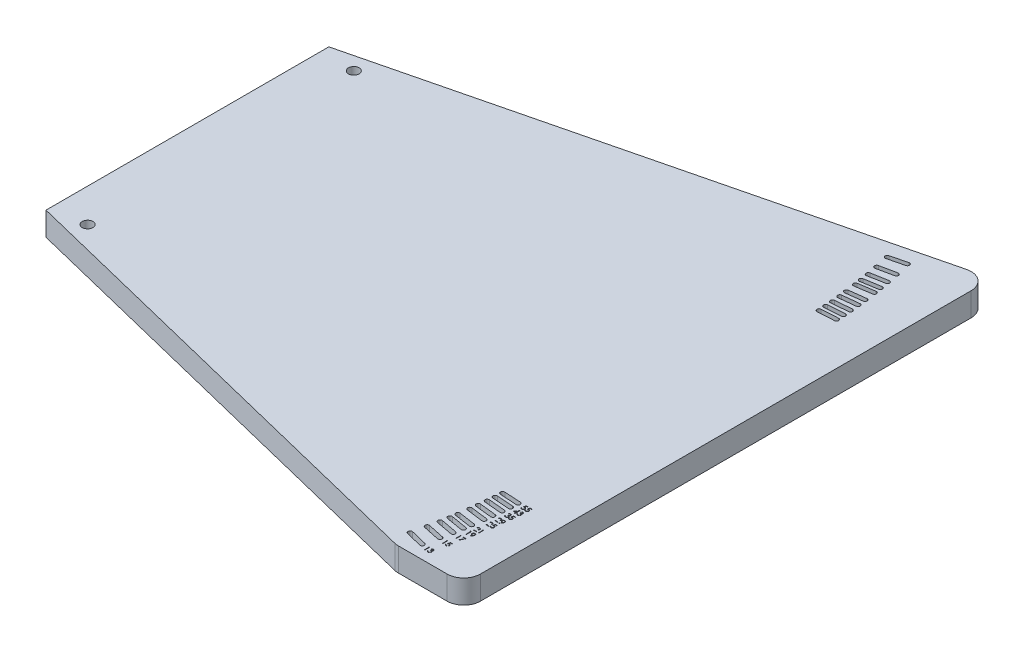
from build123d import *

# Parameters (mm, degrees)
SKETCH1_R           = 4.064
BOSS_EXTRUDE1_DEPTH = 17.9832
SKETCH2_W           = 51.526520897
SKETCH2_H           = 12.7
CUT_EXTRUDE1_DEPTH  = 17.9832
FILLET1_R           = 12.7
MAGIC_CUT_DEPTH     = 456.355286142
CUT_EXTRUDE2_DEPTH  = 1.27


with BuildPart() as part:
    # Sketch1 → Boss-Extrude1 (new body)
    with BuildSketch(Plane(origin=(0, 0, 0), x_dir=(1, 0, 0), z_dir=(0, 1, 0))):
        Polygon((0, 107.95), (0, -107.95), (406.4, -208.11744601), (406.4, 208.11744601), align=None)
        with Locations(Location((25.4, 101.6, 0), (0, 0, 270))):
            Circle(SKETCH1_R, mode=Mode.SUBTRACT)
        with Locations(Location((25.4, -101.6, 0), (0, 0, 270))):
            Circle(SKETCH1_R, mode=Mode.SUBTRACT)
    extrude(amount=BOSS_EXTRUDE1_DEPTH)

    # Sketch2 → Cut-Extrude1 (cut)
    with BuildSketch(Plane(origin=(0, 17.9832, 0), x_dir=(1, 0, 0), z_dir=(0, 1, 0))):
        with Locations((380.636739551, -201.76744601)):
            Rectangle(SKETCH2_W, SKETCH2_H)
    extrude(amount=-CUT_EXTRUDE1_DEPTH, mode=Mode.SUBTRACT)

    # Fillet1
    fillet1_edges = [part.edges().sort_by_distance(p)[0] for p in [
        (406.4, 8.9916, 195.41744601),
        (354.873479103, 8.9916, 195.41744601),
        (406.4, 8.9916, -208.11744601),
    ]]
    fillet(fillet1_edges, radius=FILLET1_R)

    # Sketch3 → Magic Cut (cut, through all)
    with BuildSketch(Plane(origin=(0, 17.9832, 0), x_dir=(1, 0, 0), z_dir=(0, 1, 0))):
        with BuildLine():
            Line((364.121521833, -186.72234315), (351.790560548, -183.683035041))
            ThreePointArc((351.790560548, -183.683035041), (350.629103901, -181.761751367), (352.550387575, -180.60029472))
            Line((352.550387575, -180.60029472), (364.88134886, -183.639602829))
            ThreePointArc((364.88134886, -183.639602829), (366.042805507, -185.560886503), (364.121521833, -186.72234315))
        make_face()
        with BuildLine():
            Line((366.687989747, -175.765967334), (354.265515218, -173.125488861))
            ThreePointArc((354.265515218, -173.125488861), (353.042765711, -171.242619736), (354.925634836, -170.019870229))
            Line((354.925634836, -170.019870229), (367.348109365, -172.660348702))
            ThreePointArc((367.348109365, -172.660348702), (368.570858872, -174.543217827), (366.687989747, -175.765967334))
        make_face()
        with BuildLine():
            Line((368.411647306, -167.335017066), (355.927889132, -165.001397164))
            ThreePointArc((355.927889132, -165.001397164), (354.659121848, -163.149224905), (356.511294107, -161.880457621))
            Line((356.511294107, -161.880457621), (368.995052281, -164.214077522))
            ThreePointArc((368.995052281, -164.214077522), (370.263819566, -166.066249782), (368.411647306, -167.335017066))
        make_face()
        with BuildLine():
            Line((371.697092926, -146.947613911), (359.097236219, -145.355881844))
            ThreePointArc((359.097236219, -145.355881844), (357.721220639, -143.581933248), (359.495169236, -142.205917668))
            Line((359.495169236, -142.205917668), (372.095025942, -143.797649734))
            ThreePointArc((372.095025942, -143.797649734), (373.471041522, -145.571598331), (371.697092926, -146.947613911))
        make_face()
        with BuildLine():
            Line((370.51256106, -155.22278298), (357.954409582, -153.329946106))
            ThreePointArc((357.954409582, -153.329946106), (356.621245256, -151.523572562), (358.4276188, -150.190408236))
            Line((358.4276188, -150.190408236), (370.985770279, -152.08324511))
            ThreePointArc((370.985770279, -152.08324511), (372.318934605, -153.889618655), (370.51256106, -155.22278298))
        make_face()
        with BuildLine():
            Line((373.989781161, -123.123176487), (361.310493538, -122.398148649))
            ThreePointArc((361.310493538, -122.398148649), (359.816211065, -120.722609217), (361.491750497, -119.228326744))
            Line((361.491750497, -119.228326744), (374.171038121, -119.953354581))
            ThreePointArc((374.171038121, -119.953354581), (375.665320594, -121.628894014), (373.989781161, -123.123176487))
        make_face()
        with BuildLine():
            Line((373.101719857, -134.487636959), (360.45284632, -133.349217768))
            ThreePointArc((360.45284632, -133.349217768), (359.014039527, -131.625806177), (360.737451118, -130.186999384))
            Line((360.737451118, -130.186999384), (373.386324655, -131.325418575))
            ThreePointArc((373.386324655, -131.325418575), (374.825131448, -133.048830166), (373.101719857, -134.487636959))
        make_face()
        with BuildLine():
            Line((369.625391518, -160.65050796), (357.098602957, -158.560156709))
            ThreePointArc((357.098602957, -158.560156709), (355.794048294, -156.733014233), (357.62119077, -155.428459569))
            Line((357.62119077, -155.428459569), (370.147979331, -157.51881082))
            ThreePointArc((370.147979331, -157.51881082), (371.452533995, -159.345953296), (369.625391518, -160.65050796))
        make_face()
        with BuildLine():
            Line((373.602419777, -128.676881614), (360.936299782, -127.749841009))
            ThreePointArc((360.936299782, -127.749841009), (359.468914858, -126.050695935), (361.168059933, -124.583311011))
            Line((361.168059933, -124.583311011), (373.834179928, -125.510351615))
            ThreePointArc((373.834179928, -125.510351615), (375.301564852, -127.20949669), (373.602419777, -128.676881614))
        make_face()
        with BuildLine():
            Line((372.431042287, -140.938763907), (359.805490242, -139.565652274))
            ThreePointArc((359.805490242, -139.565652274), (358.39893519, -137.815819314), (360.14876815, -136.409264263))
            Line((360.14876815, -136.409264263), (372.774320195, -137.782375895))
            ThreePointArc((372.774320195, -137.782375895), (374.180875246, -139.532208855), (372.431042287, -140.938763907))
        make_face()
    magic_cut = extrude(amount=-MAGIC_CUT_DEPTH, mode=Mode.SUBTRACT)

    # Mirror1: Magic Cut across plane
    add(magic_cut.mirror(Plane.XY), mode=Mode.SUBTRACT)

    # Sketch5 → Cut-Extrude2 (cut)
    # profile 1 of 20: a face of its own
    with BuildSketch(Plane(origin=(0, 17.9832, 0), x_dir=(1, 0, 0), z_dir=(0, 1, 0))):
        Polygon((368.624930021, -184.413088888), (369.329383146, -184.413088888), (369.329383146, -188.223088888), (368.987460069, -188.223088888), (368.987460069, -184.803858119), (368.401306223, -184.803858119), align=None)
    # profile 2 of 20: a face of its own
    with BuildSketch(Plane(origin=(0, 17.9832, 0), x_dir=(1, 0, 0), z_dir=(0, 1, 0))):
        with BuildLine():
            Line((371.234383146, -185.292319658), (370.892460069, -185.292319658))
            add(Edge.make_bspline(
                [(370.892460069, -185.292319658), (370.901723323, -185.253966582), (370.919832226, -185.178989457), (370.957603013, -185.071866124), (370.998750203, -184.97049452), (371.048159485, -184.876772794), (371.1020533, -184.788817417), (371.163800034, -184.708623313), (371.230550932, -184.634150913), (371.304383234, -184.568060217), (371.381811863, -184.508213032), (371.463927835, -184.457186184), (371.549079042, -184.413290463), (371.637855452, -184.377127868), (371.730521371, -184.349885798), (371.826239046, -184.330120818), (371.925259314, -184.317285348), (371.992475977, -184.31603266), (372.026606704, -184.315396581)],
                knots=[0, 0, 0, 0, 1.162005537, 2.271625781, 3.343758855, 4.383309926, 5.390229558, 6.379919256, 7.361854164, 8.333198761, 9.295911338, 10.242430842, 11.177959212, 12.116337295, 13.062827104, 14.020064771, 14.994644689, 16, 16, 16, 16], degree=3))
            add(Edge.make_bspline(
                [(372.026606704, -184.315396581), (372.076335631, -184.316897971), (372.174708755, -184.319868003), (372.319230815, -184.346989147), (372.458597152, -184.389906219), (372.591282304, -184.449204762), (372.714528655, -184.522342952), (372.82418719, -184.60939028), (372.91877154, -184.708667233), (372.998122277, -184.818321825), (373.060252491, -184.935512537), (373.106066514, -185.056126422), (373.133957544, -185.179877368), (373.137572207, -185.263433149), (373.139383146, -185.305294417)],
                knots=[0, 0, 0, 0, 1.083050992, 2.142477498, 3.193116406, 4.255571735, 5.30263384, 6.308962982, 7.297363603, 8.282367274, 9.249857812, 10.179914175, 11.08814088, 12, 12, 12, 12], degree=3))
            add(Edge.make_bspline(
                [(373.139383146, -185.305294417), (373.138116494, -185.345578957), (373.135637853, -185.424409549), (373.114591733, -185.53949495), (373.079173687, -185.647961949), (373.030112031, -185.750267157), (372.966603087, -185.845761911), (372.889670808, -185.934661067), (372.798772196, -186.017358922), (372.729888552, -186.064732976), (372.694425213, -186.089122542)],
                knots=[0, 0, 0, 0, 1.024540389, 2.004866551, 2.965041327, 3.920577974, 4.882998113, 5.874504559, 6.905732034, 8, 8, 8, 8], degree=3))
            add(Edge.make_bspline(
                [(372.694425213, -186.089122542), (372.734954638, -186.108693066), (372.815255149, -186.147467934), (372.924711583, -186.223510916), (373.02407407, -186.311311111), (373.079486404, -186.379828685), (373.107327858, -186.414254754)],
                knots=[0, 0, 0, 0, 1.015518401, 2.012035669, 3.001164323, 4, 4, 4, 4], degree=3))
            add(Edge.make_bspline(
                [(373.107327858, -186.414254754), (373.125660862, -186.439354763), (373.162026654, -186.489143753), (373.206914478, -186.569193405), (373.247636971, -186.650130312), (373.279369067, -186.734123836), (373.303942333, -186.82020046), (373.321507557, -186.908507982), (373.33241955, -186.999118515), (373.333982251, -187.060418673), (373.334767761, -187.091231917)],
                knots=[0, 0, 0, 0, 1.025084078, 2.033381695, 3.024893161, 4.013698104, 4.991890475, 5.976764909, 6.982997093, 8, 8, 8, 8], degree=3))
            add(Edge.make_bspline(
                [(373.334767761, -187.091231917), (373.332814305, -187.144582499), (373.328916586, -187.251032595), (373.294077865, -187.408303649), (373.240070309, -187.562037696), (373.163372901, -187.709076307), (373.069899985, -187.846650379), (372.95869444, -187.969742018), (372.831019807, -188.075549641), (372.688628515, -188.163952775), (372.534359298, -188.234620571), (372.369358439, -188.283668816), (372.196003381, -188.315614032), (372.077123437, -188.319039624), (372.016684829, -188.320781196)],
                knots=[0, 0, 0, 0, 0.955779014, 1.907060117, 2.875433937, 3.871313158, 4.872415639, 5.851225146, 6.836215519, 7.83643374, 8.849228613, 9.86973379, 10.916971861, 12, 12, 12, 12], degree=3))
            add(Edge.make_bspline(
                [(372.016684829, -188.320781196), (371.975951248, -188.319836084), (371.895801143, -188.317976418), (371.777970363, -188.305263427), (371.665497313, -188.282044192), (371.558229922, -188.250798594), (371.456072897, -188.211183584), (371.359337971, -188.161850944), (371.267430001, -188.103817566), (371.181216286, -188.036398432), (371.100707102, -187.960980745), (371.028041994, -187.876225651), (370.962009477, -187.783699906), (370.904377633, -187.682328807), (370.852521407, -187.573422399), (370.809870137, -187.455586176), (370.772330132, -187.329873569), (370.754876561, -187.242267801), (370.745921608, -187.197319658)],
                knots=[0, 0, 0, 0, 1.048658725, 2.063410685, 3.046034179, 4.001477787, 4.936774919, 5.862367409, 6.792675028, 7.730719943, 8.675894397, 9.627829632, 10.600096036, 11.597688215, 12.626045268, 13.701542398, 14.82072376, 16, 16, 16, 16], degree=3))
            Line((370.745921608, -187.197319658), (371.087844684, -187.197319658))
            add(Edge.make_bspline(
                [(371.087844684, -187.197319658), (371.096752782, -187.226655583), (371.114079805, -187.283716507), (371.143573883, -187.365838669), (371.177176202, -187.44112215), (371.213223765, -187.510119205), (371.251082587, -187.573509335), (371.293444263, -187.629616341), (371.337171247, -187.680904604), (371.370132486, -187.70980031), (371.386264156, -187.723942254)],
                knots=[0, 0, 0, 0, 1.198163088, 2.33053128, 3.407730985, 4.417276592, 5.372219308, 6.28897303, 7.162600585, 8, 8, 8, 8], degree=3))
            add(Edge.make_bspline(
                [(371.386264156, -187.723942254), (371.407596429, -187.740388754), (371.450195128, -187.773230989), (371.519611402, -187.815142762), (371.592616321, -187.851458621), (371.670791723, -187.879199444), (371.752450659, -187.902688269), (371.83891302, -187.918059462), (371.929415996, -187.928605729), (371.991211761, -187.929536383), (372.022790598, -187.930011965)],
                knots=[0, 0, 0, 0, 0.946170439, 1.889420265, 2.845303464, 3.807233317, 4.801018734, 5.828864929, 6.890507805, 8, 8, 8, 8], degree=3))
            add(Edge.make_bspline(
                [(372.022790598, -187.930011965), (372.058445125, -187.929341508), (372.128164475, -187.928030488), (372.229896765, -187.91597379), (372.326678872, -187.898414683), (372.417436257, -187.871295121), (372.503357752, -187.837787966), (372.583238919, -187.795716416), (372.658128395, -187.746355448), (372.727066976, -187.690251392), (372.789056229, -187.628832565), (372.84363667, -187.564592621), (372.890036659, -187.497802418), (372.92746564, -187.42809235), (372.957020953, -187.355751086), (372.977141237, -187.280575618), (372.991131029, -187.203181165), (372.992270341, -187.15057163), (372.992844684, -187.124050427)],
                knots=[0, 0, 0, 0, 1.217147791, 2.380027433, 3.494444702, 4.572153297, 5.609568379, 6.639424714, 7.649109417, 8.668170816, 9.669597737, 10.625200337, 11.543417969, 12.441394052, 13.322311151, 14.205496177, 15.095365482, 16, 16, 16, 16], degree=3))
            add(Edge.make_bspline(
                [(372.992844684, -187.124050427), (372.991178842, -187.088550655), (372.987855446, -187.017727753), (372.962482392, -186.913532337), (372.9207478, -186.813140565), (372.862321438, -186.718265262), (372.79119883, -186.630334924), (372.708070175, -186.551879967), (372.61224516, -186.487142525), (372.524049246, -186.442414588), (372.445927747, -186.411894229), (372.379072714, -186.391565196), (372.30422624, -186.374350902), (372.222293443, -186.358335544), (372.13265697, -186.344705162), (372.035414408, -186.3333385), (371.93054605, -186.324243441), (371.857947953, -186.320181877), (371.820536992, -186.318088888)],
                knots=[0, 0, 0, 0, 1.07054697, 2.135767047, 3.216561865, 4.33974944, 5.486079747, 6.621378074, 7.775625952, 8.963672916, 9.598146892, 10.304877434, 11.070270905, 11.915000392, 12.823868403, 13.805723172, 14.86925407, 16, 16, 16, 16], degree=3))
            Line((371.820536992, -186.318088888), (371.820536992, -185.927319658))
            add(Edge.make_bspline(
                [(371.820536992, -185.927319658), (371.867673404, -185.926519771), (371.960002056, -185.92495299), (372.094869856, -185.906003128), (372.223836518, -185.879789644), (372.344043915, -185.839637478), (372.453607228, -185.793002754), (372.548660852, -185.738735063), (372.62787309, -185.678412151), (372.690858999, -185.611102939), (372.738243674, -185.538914273), (372.772889416, -185.463675854), (372.793354914, -185.384728233), (372.796086866, -185.330849752), (372.797460069, -185.303767975)],
                knots=[0, 0, 0, 0, 1.321986639, 2.589447074, 3.816329219, 5.01088745, 6.139805852, 7.153945165, 8.075214402, 8.924034688, 9.728124013, 10.488707548, 11.240355623, 12, 12, 12, 12], degree=3))
            add(Edge.make_bspline(
                [(372.797460069, -185.303767975), (372.797008953, -185.283871344), (372.796111479, -185.24428794), (372.7847933, -185.186457508), (372.767785415, -185.13039505), (372.744403196, -185.076338976), (372.713106551, -185.024664192), (372.675653177, -184.974930141), (372.631056473, -184.92742077), (372.579953001, -184.883137336), (372.525076151, -184.840934252), (372.464932824, -184.805105407), (372.40133644, -184.774467497), (372.33421659, -184.749202296), (372.263355456, -184.730196614), (372.189085975, -184.716550455), (372.111266525, -184.708018608), (372.058175011, -184.706790247), (372.031186031, -184.706165811)],
                knots=[0, 0, 0, 0, 0.884392785, 1.759457502, 2.611959086, 3.489218968, 4.37281399, 5.2945488, 6.255912374, 7.266815255, 8.301784654, 9.332968512, 10.37626691, 11.440494194, 12.520033166, 13.637162961, 14.798855837, 16, 16, 16, 16], degree=3))
            add(Edge.make_bspline(
                [(372.031186031, -184.706165811), (371.987804643, -184.707680408), (371.903070705, -184.710638768), (371.780916752, -184.736550049), (371.667357706, -184.777891905), (371.580556472, -184.827240135), (371.516458584, -184.875954179), (371.470654831, -184.918498148), (371.425674504, -184.965777879), (371.384476781, -185.020705425), (371.342812824, -185.079560988), (371.30488203, -185.145336481), (371.268023336, -185.216316122), (371.245813704, -185.266494512), (371.234383146, -185.292319658)],
                knots=[0, 0, 0, 0, 1.472543308, 2.876219568, 4.221790263, 5.565193594, 6.249813518, 6.953379497, 7.687249741, 8.463570142, 9.283606569, 10.136032583, 11.040678096, 12, 12, 12, 12], degree=3))
        make_face()
    # profile 3 of 20: a face of its own
    with BuildSketch(Plane(origin=(0, 17.9832, 0), x_dir=(1, 0, 0), z_dir=(0, 1, 0))):
        Polygon((371.237904522, -173.341661606), (371.942357647, -173.341661606), (371.942357647, -177.151661606), (371.60043457, -177.151661606), (371.60043457, -173.732430837), (371.014280724, -173.732430837), align=None)
    # profile 4 of 20: a face of its own
    with BuildSketch(Plane(origin=(0, 17.9832, 0), x_dir=(1, 0, 0), z_dir=(0, 1, 0))):
        with BuildLine():
            Line((375.752357647, -173.341661606), (375.752357647, -173.732430837))
            Line((375.752357647, -173.732430837), (374.456408128, -173.732430837))
            Line((374.456408128, -173.732430837), (374.251101637, -174.734540212))
            add(Edge.make_bspline(
                [(374.251101637, -174.734540212), (374.291439604, -174.723403831), (374.369588033, -174.701828853), (374.48493291, -174.677874), (374.594434709, -174.663433616), (374.665491612, -174.661461875), (374.699875676, -174.66050776)],
                knots=[0, 0, 0, 0, 1.100273476, 2.13160584, 3.095893838, 4, 4, 4, 4], degree=3))
            add(Edge.make_bspline(
                [(374.699875676, -174.66050776), (374.742421118, -174.661428622), (374.826076088, -174.663239265), (374.948473913, -174.680625764), (375.065313434, -174.707992357), (375.1763503, -174.746223554), (375.281789928, -174.795111006), (375.380662216, -174.856179798), (375.474451259, -174.92751751), (375.561474482, -175.009535937), (375.640422372, -175.09980204), (375.709836206, -175.196856751), (375.768796055, -175.299756863), (375.816215048, -175.409485526), (375.85408028, -175.524829633), (375.87928288, -175.647002816), (375.896065069, -175.774853484), (375.89794001, -175.862270744), (375.898896109, -175.906847904)],
                knots=[0, 0, 0, 0, 1.052922333, 2.070308379, 3.05430497, 4.020497103, 4.973039431, 5.925935799, 6.892292201, 7.88610001, 8.88166317, 9.857072816, 10.836096531, 11.812156883, 12.81219415, 13.836441305, 14.89672472, 16, 16, 16, 16], degree=3))
            add(Edge.make_bspline(
                [(375.898896109, -175.906847904), (375.898172127, -175.937896379), (375.896733947, -175.999573734), (375.889420284, -176.091170706), (375.875338833, -176.180828533), (375.856432825, -176.268559108), (375.831893793, -176.354196339), (375.802187709, -176.437985345), (375.765833747, -176.519404617), (375.725957879, -176.599224547), (375.681058141, -176.675640637), (375.631224966, -176.747104248), (375.578575674, -176.814687423), (375.521924909, -176.877665343), (375.460746111, -176.935624171), (375.395780204, -176.988907872), (375.327545587, -177.038417549), (375.254986595, -177.082143498), (375.179720064, -177.122380316), (375.100659062, -177.155389653), (375.019603271, -177.184901399), (374.935386077, -177.208424913), (374.848198241, -177.226857208), (374.757896043, -177.239376434), (374.664953085, -177.248494784), (374.601952, -177.249065584), (374.57012808, -177.249353914)],
                knots=[0, 0, 0, 0, 1.056347294, 2.098418968, 3.122841568, 4.141288669, 5.149314143, 6.15115421, 7.162517403, 8.180376062, 9.185164535, 10.17417709, 11.141909838, 12.097768115, 13.052685741, 14.0056014, 14.954263652, 15.917497458, 16.885230207, 17.854509472, 18.828990115, 19.81800267, 20.826176721, 21.857883937, 22.917946725, 24, 24, 24, 24], degree=3))
            add(Edge.make_bspline(
                [(374.57012808, -177.249353914), (374.532165043, -177.248601888), (374.457477253, -177.247122364), (374.348053436, -177.231644527), (374.242772679, -177.20947695), (374.142482483, -177.176127182), (374.046284051, -177.13433987), (373.955472464, -177.081526552), (373.867727319, -177.02167787), (373.786615644, -176.951050972), (373.711334275, -176.873854186), (373.643944618, -176.790080297), (373.583927782, -176.701111961), (373.532244863, -176.606517114), (373.488159874, -176.506544313), (373.453526987, -176.400818989), (373.425574264, -176.289893556), (373.413748654, -176.213526449), (373.407742262, -176.174738529)],
                knots=[0, 0, 0, 0, 1.0467383, 2.05933395, 3.04377827, 4.011590433, 4.970194871, 5.932262533, 6.905835911, 7.896367577, 8.894135286, 9.877477877, 10.858688626, 11.851381753, 12.8477658, 13.868841284, 14.917554742, 16, 16, 16, 16], degree=3))
            Line((373.407742262, -176.174738529), (373.749665339, -176.174738529))
            add(Edge.make_bspline(
                [(373.749665339, -176.174738529), (373.758078426, -176.211071182), (373.774248846, -176.280904558), (373.809742532, -176.379018961), (373.853139386, -176.466452173), (373.904742405, -176.544360776), (373.966301152, -176.612297427), (374.036546045, -176.672840572), (374.115301709, -176.727459784), (374.202815482, -176.772986854), (374.295140577, -176.811814839), (374.391770026, -176.837670256), (374.490072757, -176.855850371), (374.556560926, -176.857670202), (374.58997183, -176.858584683)],
                knots=[0, 0, 0, 0, 1.136247022, 2.183929868, 3.172523383, 4.106158343, 5.02341133, 5.958108904, 6.928429099, 7.938127109, 8.96079061, 9.975095812, 10.982467395, 12, 12, 12, 12], degree=3))
            add(Edge.make_bspline(
                [(374.58997183, -176.858584683), (374.622583736, -176.857691208), (374.686796847, -176.855931948), (374.781297243, -176.842391194), (374.872533543, -176.82153681), (374.959605494, -176.790327625), (375.04403677, -176.75239666), (375.123691646, -176.703721106), (375.200874492, -176.6477032), (375.27318626, -176.583524697), (375.339414346, -176.512800544), (375.397931724, -176.437169438), (375.446674593, -176.356487957), (375.487750865, -176.272152896), (375.518942028, -176.183239952), (375.541193496, -176.090165816), (375.554259683, -175.992700595), (375.55605711, -175.926222289), (375.556973032, -175.892346703)],
                knots=[0, 0, 0, 0, 1.027316725, 2.022795036, 3.002884548, 3.971462791, 4.93288096, 5.914575861, 6.907176829, 7.935150275, 8.956128384, 9.956726525, 10.942570165, 11.921478529, 12.907843606, 13.90538589, 14.932640048, 16, 16, 16, 16], degree=3))
            add(Edge.make_bspline(
                [(375.556973032, -175.892346703), (375.55625623, -175.861784241), (375.554853192, -175.801962573), (375.543389914, -175.714442293), (375.523450581, -175.631631353), (375.495774872, -175.553129858), (375.460636322, -175.478863768), (375.417696193, -175.408756437), (375.366148637, -175.343731893), (375.307265753, -175.283759713), (375.242759143, -175.228411435), (375.171518954, -175.181228301), (375.095036005, -175.141534722), (375.014231784, -175.107279558), (374.92718428, -175.082677032), (374.835617318, -175.064206277), (374.738542101, -175.053521554), (374.672171152, -175.052039041), (374.638054762, -175.051276991)],
                knots=[0, 0, 0, 0, 1.045622112, 2.046656509, 3.013763289, 3.955457236, 4.890082067, 5.820317437, 6.762574623, 7.722996705, 8.69280354, 9.665887285, 10.63943826, 11.638615906, 12.663482002, 13.728887084, 14.832589034, 16, 16, 16, 16], degree=3))
            add(Edge.make_bspline(
                [(374.638054762, -175.051276991), (374.608522986, -175.051909006), (374.547547359, -175.053213956), (374.454014225, -175.062822229), (374.355725235, -175.078322718), (374.25305717, -175.099643747), (374.145701702, -175.127545005), (374.033885386, -175.160979933), (373.917373119, -175.200954451), (373.838867824, -175.231142947), (373.798511493, -175.246661606)],
                knots=[0, 0, 0, 0, 0.817624296, 1.688186739, 2.600797293, 3.572016777, 4.590301741, 5.671205678, 6.80286297, 8, 8, 8, 8], degree=3))
            Line((373.798511493, -175.246661606), (374.189280724, -173.341661606))
            Line((374.189280724, -173.341661606), (375.752357647, -173.341661606))
        make_face()
    # profile 5 of 20: a face of its own
    with BuildSketch(Plane(origin=(0, 17.9832, 0), x_dir=(1, 0, 0), z_dir=(0, 1, 0))):
        Polygon((372.994611117, -164.821753906), (373.699064242, -164.821753906), (373.699064242, -168.631753906), (373.357141165, -168.631753906), (373.357141165, -165.212523137), (372.770987319, -165.212523137), align=None)
    # profile 6 of 20: a face of its own
    with BuildSketch(Plane(origin=(0, 17.9832, 0), x_dir=(1, 0, 0), z_dir=(0, 1, 0))):
        Polygon((375.359833473, -164.821753906), (377.704448857, -164.821753906), (375.70175655, -168.729446214), (375.406389963, -168.566880108), (377.125927223, -165.212523137), (375.359833473, -165.212523137), align=None)
    # profile 7 of 20: a face of its own
    with BuildSketch(Plane(origin=(0, 17.9832, 0), x_dir=(1, 0, 0), z_dir=(0, 1, 0))):
        Polygon((374.232892583, -158.066455923), (374.937345708, -158.066455923), (374.937345708, -161.876455923), (374.595422631, -161.876455923), (374.595422631, -158.457225153), (374.009268785, -158.457225153), align=None)
    # profile 8 of 20: a face of its own
    with BuildSketch(Plane(origin=(0, 17.9832, 0), x_dir=(1, 0, 0), z_dir=(0, 1, 0))):
        with BuildLine():
            Line((377.184268785, -161.97414823), (376.911035612, -161.784106163))
            Line((376.911035612, -161.784106163), (377.970386573, -160.235530442))
            add(Edge.make_bspline(
                [(377.970386573, -160.235530442), (377.902796372, -160.243796034), (377.769707499, -160.260071445), (377.635663968, -160.263061375), (377.569695467, -160.264532846)],
                knots=[0, 0, 0, 0, 1.015715272, 2, 2, 2, 2], degree=3))
            add(Edge.make_bspline(
                [(377.569695467, -160.264532846), (377.529699124, -160.263508417), (377.451189799, -160.261497552), (377.335766772, -160.245558898), (377.224857062, -160.221011473), (377.118754706, -160.1843824), (377.017060902, -160.138860293), (376.919997654, -160.082410229), (376.827695624, -160.016000523), (376.74114613, -159.939982324), (376.662429637, -159.856512787), (376.592300275, -159.768169072), (376.534016929, -159.673924944), (376.485600989, -159.575702905), (376.448882981, -159.472091206), (376.422144904, -159.364268859), (376.405683141, -159.251480186), (376.403724697, -159.174708544), (376.402730323, -159.135728759)],
                knots=[0, 0, 0, 0, 1.060718605, 2.082097864, 3.085795603, 4.069760067, 5.054557537, 6.03741023, 7.043284206, 8.066802108, 9.088538119, 10.083643548, 11.053783639, 12.022749082, 12.983451788, 13.964007469, 14.966251758, 16, 16, 16, 16], degree=3))
            add(Edge.make_bspline(
                [(376.402730323, -159.135728759), (376.404618379, -159.082422883), (376.408324251, -158.977794261), (376.438149494, -158.824922073), (376.487200891, -158.680374435), (376.555594067, -158.544531396), (376.641737864, -158.419347054), (376.745270358, -158.306561682), (376.865561816, -158.207779427), (376.999871957, -158.122866417), (377.145036245, -158.054574892), (377.297075556, -158.00424011), (377.454824927, -157.97463233), (377.561687448, -157.970728864), (377.615488737, -157.968763615)],
                knots=[0, 0, 0, 0, 1.022988612, 2.007919123, 2.978103895, 3.94594894, 4.918897164, 5.887013414, 6.875921846, 7.89917871, 8.930658928, 9.948724884, 10.967259574, 12, 12, 12, 12], degree=3))
            add(Edge.make_bspline(
                [(377.615488737, -157.968763615), (377.668271845, -157.970755878), (377.772566292, -157.974692403), (377.925934039, -158.003522095), (378.072826974, -158.052112301), (378.212430803, -158.119260355), (378.341687134, -158.203429686), (378.457920232, -158.303724696), (378.558477604, -158.420207856), (378.643194457, -158.550061898), (378.711197558, -158.689580812), (378.760261958, -158.835214167), (378.790465068, -158.985914604), (378.794271069, -159.088016588), (378.796191862, -159.139544865)],
                knots=[0, 0, 0, 0, 1.026385292, 2.028040595, 3.023318987, 4.028184125, 5.03290303, 6.015178782, 7.004435299, 8.016004309, 9.023023918, 10.015172535, 10.998308025, 12, 12, 12, 12], degree=3))
            add(Edge.make_bspline(
                [(378.796191862, -159.139544865), (378.794909079, -159.17954308), (378.792307276, -159.260669454), (378.774088611, -159.38392877), (378.743151209, -159.50960568), (378.708042931, -159.615982617), (378.674153343, -159.70383953), (378.642256968, -159.773237678), (378.606865167, -159.846282196), (378.565587882, -159.922207156), (378.521215211, -160.001980429), (378.471076398, -160.0848019), (378.41631519, -160.170782707), (378.377311981, -160.228745966), (378.357339698, -160.258427077)],
                knots=[0, 0, 0, 0, 1.179839688, 2.393009684, 3.667231171, 4.993948276, 5.694988576, 6.444077775, 7.246288328, 8.089075292, 8.993003841, 9.939041771, 10.944649915, 12, 12, 12, 12], degree=3))
            Line((378.357339698, -160.258427077), (377.184268785, -161.97414823))
        make_face()
        with BuildLine():
            add(Edge.make_bspline(
                [(377.633042823, -159.873763615), (377.663342136, -159.872935883), (377.722324597, -159.87132457), (377.808732456, -159.861517367), (377.890292804, -159.844128542), (377.967223506, -159.819178798), (378.040295934, -159.789072539), (378.108349423, -159.750741777), (378.171440927, -159.705003668), (378.229992928, -159.653612194), (378.281987453, -159.596515987), (378.328298581, -159.536756566), (378.367661942, -159.474071604), (378.398755109, -159.407676082), (378.424319747, -159.339186206), (378.441974211, -159.267499037), (378.4517543, -159.192988063), (378.453421529, -159.142370953), (378.454268785, -159.11664823)],
                knots=[0, 0, 0, 0, 1.163407946, 2.26475976, 3.333800367, 4.359385343, 5.366239384, 6.363380779, 7.350133999, 8.353570782, 9.349036268, 10.310270964, 11.253520213, 12.184142, 13.120487599, 14.056272588, 15.012232024, 16, 16, 16, 16], degree=3))
            add(Edge.make_bspline(
                [(378.454268785, -159.11664823), (378.453539802, -159.090914766), (378.452103252, -159.040203819), (378.44057822, -158.96558253), (378.420303334, -158.894070724), (378.393099407, -158.825276896), (378.357263376, -158.759766262), (378.314261011, -158.696716345), (378.263171687, -158.636526914), (378.204386036, -158.580613549), (378.140993565, -158.529071979), (378.073436278, -158.48358485), (378.002271012, -158.445461777), (377.927931936, -158.414003184), (377.850264162, -158.389453965), (377.769313649, -158.371800205), (377.684671336, -158.36203381), (377.627215136, -158.360377119), (377.59793465, -158.359532846)],
                knots=[0, 0, 0, 0, 0.972161553, 1.915763587, 2.844109794, 3.775983486, 4.705125789, 5.659731448, 6.655561913, 7.682237399, 8.721216875, 9.739758359, 10.754845918, 11.767244016, 12.7857855, 13.828538656, 14.893392813, 16, 16, 16, 16], degree=3))
            add(Edge.make_bspline(
                [(377.59793465, -158.359532846), (377.568908815, -158.360378483), (377.511960364, -158.362037615), (377.428070522, -158.371781641), (377.347667365, -158.389572691), (377.27022463, -158.413991813), (377.195887763, -158.445464123), (377.124725854, -158.483586848), (377.057152764, -158.529061508), (376.993821071, -158.580654103), (376.934931618, -158.636266655), (376.884720685, -158.696980016), (376.841619906, -158.759733465), (376.805833117, -158.825285612), (376.778616091, -158.894068397), (376.758344712, -158.965583161), (376.746818738, -159.040203654), (376.745382317, -159.090914711), (376.7446534, -159.11664823)],
                knots=[0, 0, 0, 0, 1.099389452, 2.15699305, 3.192601482, 4.213358962, 5.227959689, 6.245255729, 7.266013209, 8.307253147, 9.336162325, 10.327954924, 11.284637477, 12.215801273, 13.149702402, 14.080068371, 15.025723358, 16, 16, 16, 16], degree=3))
            add(Edge.make_bspline(
                [(376.7446534, -159.11664823), (376.745312994, -159.142390984), (376.746613834, -159.193160405), (376.759162656, -159.267756279), (376.780148441, -159.33926257), (376.808254692, -159.408374562), (376.845267851, -159.474420214), (376.89068724, -159.537086399), (376.94392442, -159.597083503), (377.004267731, -159.653479354), (377.070309358, -159.705243294), (377.140845244, -159.750452081), (377.214661095, -159.788630942), (377.292016756, -159.819264848), (377.372338958, -159.843879259), (377.456349601, -159.861485319), (377.543770854, -159.8712305), (377.603000006, -159.872911142), (377.633042823, -159.873763615)],
                knots=[0, 0, 0, 0, 0.952633368, 1.87876736, 2.791047057, 3.707742249, 4.635551637, 5.587206343, 6.568248508, 7.601284464, 8.641511608, 9.671105535, 10.699146789, 11.713763218, 12.747829548, 13.806491675, 14.887386225, 16, 16, 16, 16], degree=3))
        make_face(mode=Mode.SUBTRACT)
    # profile 9 of 20: a face of its own
    with BuildSketch(Plane(origin=(0, 17.9832, 0), x_dir=(1, 0, 0), z_dir=(0, 1, 0))):
        with BuildLine():
            Line((376.029040247, -145.390051464), (375.68711717, -145.390051464))
            add(Edge.make_bspline(
                [(375.68711717, -145.390051464), (375.689345642, -145.344689726), (375.693722302, -145.25560048), (375.71421824, -145.125707885), (375.743545309, -145.00155109), (375.785010578, -144.884126983), (375.83650684, -144.77239731), (375.898261527, -144.666805865), (375.971406833, -144.567755456), (376.054363306, -144.476164315), (376.144462882, -144.392140131), (376.241678776, -144.319581138), (376.343835792, -144.25827533), (376.450623994, -144.207024036), (376.563248208, -144.168554089), (376.680686405, -144.140009962), (376.80345455, -144.122836282), (376.887100403, -144.120990299), (376.929641208, -144.120051464)],
                knots=[0, 0, 0, 0, 1.10065271, 2.161652631, 3.183658789, 4.190468796, 5.17591951, 6.163126047, 7.15150782, 8.156236427, 9.156009102, 10.134482811, 11.092018607, 12.041330605, 13.001268258, 13.972401359, 14.968799086, 16, 16, 16, 16], degree=3))
            add(Edge.make_bspline(
                [(376.929641208, -144.120051464), (376.971418483, -144.121029498), (377.053509336, -144.1229513), (377.1733197, -144.139455163), (377.28737727, -144.165303936), (377.395459095, -144.201570146), (377.49670284, -144.250321194), (377.591869069, -144.308883658), (377.682090751, -144.376614388), (377.763305564, -144.456356397), (377.837881502, -144.541485278), (377.902218528, -144.632367824), (377.957314572, -144.726234561), (378.003238875, -144.823801261), (378.0370457, -144.92598658), (378.062712264, -145.031302821), (378.077220106, -145.140840115), (378.079446695, -145.214978966), (378.080578708, -145.252671656)],
                knots=[0, 0, 0, 0, 1.111607364, 2.184268762, 3.212621178, 4.221274766, 5.211760367, 6.196651075, 7.1921475, 8.207485113, 9.220403448, 10.201281604, 11.166441695, 12.114753415, 13.065576456, 14.026450734, 14.996634279, 16, 16, 16, 16], degree=3))
            add(Edge.make_bspline(
                [(378.080578708, -145.252671656), (378.078735471, -145.305737156), (378.075081342, -145.410936931), (378.043823692, -145.565530253), (377.995005061, -145.715310518), (377.936225081, -145.835855981), (377.876927935, -145.932993013), (377.823492677, -146.012968946), (377.760938125, -146.099080899), (377.688353818, -146.191040515), (377.607241234, -146.2895681), (377.516865679, -146.394604134), (377.416582689, -146.505063404), (377.346197292, -146.580507501), (377.309725343, -146.619600743)],
                knots=[0, 0, 0, 0, 1.184426356, 2.348067706, 3.509069118, 4.696110526, 5.333549288, 6.050745305, 6.844228056, 7.710549037, 8.667450064, 9.695053472, 10.805634456, 12, 12, 12, 12], degree=3))
            Line((377.309725343, -146.619600743), (376.356462122, -147.636974541))
            Line((376.356462122, -147.636974541), (378.129424862, -147.636974541))
            Line((378.129424862, -147.636974541), (378.129424862, -148.027743771))
            Line((378.129424862, -148.027743771), (375.540578708, -148.027743771))
            Line((375.540578708, -148.027743771), (377.018174862, -146.450928868))
            add(Edge.make_bspline(
                [(377.018174862, -146.450928868), (377.054149848, -146.413374997), (377.123250432, -146.341241697), (377.22098518, -146.235930074), (377.308766479, -146.138231288), (377.387162555, -146.048329931), (377.454472742, -145.964910996), (377.514205086, -145.89067619), (377.562064772, -145.822363489), (377.614006388, -145.743180135), (377.664313608, -145.646501584), (377.707543344, -145.52835491), (377.733902937, -145.406731815), (377.737065057, -145.324542455), (377.738655631, -145.283200502)],
                knots=[0, 0, 0, 0, 1.329631726, 2.553950428, 3.673215718, 4.687767853, 5.603093632, 6.413772471, 7.123043292, 7.734684054, 8.834405432, 9.900288307, 10.943827018, 12, 12, 12, 12], degree=3))
            add(Edge.make_bspline(
                [(377.738655631, -145.283200502), (377.737963581, -145.257203894), (377.736599681, -145.205969572), (377.724562588, -145.130851874), (377.706372008, -145.05839132), (377.680305884, -144.988365023), (377.64589969, -144.921477042), (377.604018668, -144.857645956), (377.555696913, -144.795935968), (377.499797389, -144.738074807), (377.43838942, -144.685081837), (377.373516822, -144.63813819), (377.30488228, -144.598907044), (377.232775176, -144.566746837), (377.157396536, -144.541518779), (377.078600571, -144.524037868), (376.996604999, -144.513062364), (376.940615965, -144.511577366), (376.912087122, -144.510820695)],
                knots=[0, 0, 0, 0, 0.991446411, 1.95395049, 2.89581595, 3.838931463, 4.798493298, 5.75982156, 6.748411868, 7.785213223, 8.824556874, 9.840280684, 10.836137867, 11.835679398, 12.848801643, 13.863922112, 14.911575587, 16, 16, 16, 16], degree=3))
            add(Edge.make_bspline(
                [(376.912087122, -144.510820695), (376.882292015, -144.511599058), (376.823779346, -144.513127636), (376.737870341, -144.523820307), (376.655916395, -144.542267065), (376.577711352, -144.567496531), (376.503122889, -144.599564265), (376.432513743, -144.63950585), (376.366042427, -144.68716731), (376.303583983, -144.741204601), (376.246037766, -144.801367333), (376.195477024, -144.868434178), (376.151298425, -144.941180593), (376.112752946, -145.01941029), (376.081450323, -145.103833119), (376.057530979, -145.194149392), (376.038604155, -145.289966953), (376.032281165, -145.356135859), (376.029040247, -145.390051464)],
                knots=[0, 0, 0, 0, 1.031018746, 2.02475058, 2.990194455, 3.934040569, 4.864654155, 5.795059489, 6.735614925, 7.690564532, 8.649604399, 9.611025574, 10.590972636, 11.591080095, 12.624614302, 13.701020113, 14.821632451, 16, 16, 16, 16], degree=3))
        make_face()
    # profile 10 of 20: a face of its own
    with BuildSketch(Plane(origin=(0, 17.9832, 0), x_dir=(1, 0, 0), z_dir=(0, 1, 0))):
        with BuildLine():
            Line((380.864809478, -144.217743771), (380.864809478, -144.608513002))
            Line((380.864809478, -144.608513002), (379.568859958, -144.608513002))
            Line((379.568859958, -144.608513002), (379.363553468, -145.610622377))
            add(Edge.make_bspline(
                [(379.363553468, -145.610622377), (379.403891434, -145.599485996), (379.482039864, -145.577911018), (379.597384741, -145.553956165), (379.706886539, -145.539515781), (379.777943443, -145.53754404), (379.812327506, -145.536589925)],
                knots=[0, 0, 0, 0, 1.100273476, 2.13160584, 3.095893838, 4, 4, 4, 4], degree=3))
            add(Edge.make_bspline(
                [(379.812327506, -145.536589925), (379.854872949, -145.537510787), (379.938527918, -145.53932143), (380.060925744, -145.556707929), (380.177765265, -145.584074522), (380.28880213, -145.622305719), (380.394241758, -145.671193171), (380.493114047, -145.732261963), (380.586903089, -145.803599675), (380.673926313, -145.885618103), (380.752874203, -145.975884205), (380.822288037, -146.072938916), (380.881247885, -146.175839029), (380.928666878, -146.285567691), (380.966532111, -146.400911798), (380.991734711, -146.523084981), (381.0085169, -146.650935649), (381.01039184, -146.738352909), (381.011347939, -146.78293007)],
                knots=[0, 0, 0, 0, 1.052922333, 2.070308379, 3.05430497, 4.020497103, 4.973039431, 5.925935799, 6.892292201, 7.88610001, 8.88166317, 9.857072816, 10.836096531, 11.812156883, 12.81219415, 13.836441305, 14.89672472, 16, 16, 16, 16], degree=3))
            add(Edge.make_bspline(
                [(381.011347939, -146.78293007), (381.010623957, -146.813978544), (381.009185777, -146.875655899), (381.001872115, -146.967252871), (380.987790664, -147.056910698), (380.968884656, -147.144641273), (380.944345623, -147.230278504), (380.914639539, -147.31406751), (380.878285578, -147.395486782), (380.838409709, -147.475306712), (380.793509972, -147.551722802), (380.743676797, -147.623186413), (380.691027505, -147.690769588), (380.634376739, -147.753747508), (380.573197942, -147.811706337), (380.508232035, -147.864990037), (380.439997418, -147.914499714), (380.367438426, -147.958225664), (380.292171894, -147.998462482), (380.213110892, -148.031471818), (380.132055101, -148.060983564), (380.047837908, -148.084507079), (379.960650072, -148.102939374), (379.870347873, -148.115458599), (379.777404916, -148.124576949), (379.71440383, -148.125147749), (379.68257991, -148.125436079)],
                knots=[0, 0, 0, 0, 1.056347294, 2.098418968, 3.122841568, 4.141288669, 5.149314143, 6.15115421, 7.162517403, 8.180376062, 9.185164535, 10.17417709, 11.141909838, 12.097768115, 13.052685741, 14.0056014, 14.954263652, 15.917497458, 16.885230207, 17.854509472, 18.828990115, 19.81800267, 20.826176721, 21.857883937, 22.917946725, 24, 24, 24, 24], degree=3))
            add(Edge.make_bspline(
                [(379.68257991, -148.125436079), (379.644616874, -148.124684053), (379.569929084, -148.123204529), (379.460505266, -148.107726693), (379.35522451, -148.085559115), (379.254934314, -148.052209347), (379.158735881, -148.010422035), (379.067924294, -147.957608717), (378.980179149, -147.897760035), (378.899067475, -147.827133137), (378.823786106, -147.749936351), (378.756396449, -147.666162462), (378.696379613, -147.577194126), (378.644696694, -147.482599279), (378.600611705, -147.382626478), (378.565978818, -147.276901154), (378.538026094, -147.165975721), (378.526200485, -147.089608614), (378.520194093, -147.050820695)],
                knots=[0, 0, 0, 0, 1.0467383, 2.05933395, 3.04377827, 4.011590433, 4.970194871, 5.932262533, 6.905835911, 7.896367577, 8.894135286, 9.877477877, 10.858688626, 11.851381753, 12.8477658, 13.868841284, 14.917554742, 16, 16, 16, 16], degree=3))
            Line((378.520194093, -147.050820695), (378.86211717, -147.050820695))
            add(Edge.make_bspline(
                [(378.86211717, -147.050820695), (378.870530257, -147.087153347), (378.886700677, -147.156986723), (378.922194363, -147.255101126), (378.965591216, -147.342534338), (379.017194235, -147.420442941), (379.078752983, -147.488379592), (379.148997875, -147.548922737), (379.22775354, -147.603541949), (379.315267313, -147.649069019), (379.407592407, -147.687897005), (379.504221856, -147.713752421), (379.602524588, -147.731932536), (379.669012756, -147.733752367), (379.70242366, -147.734666848)],
                knots=[0, 0, 0, 0, 1.136247022, 2.183929868, 3.172523383, 4.106158343, 5.02341133, 5.958108904, 6.928429099, 7.938127109, 8.96079061, 9.975095812, 10.982467395, 12, 12, 12, 12], degree=3))
            add(Edge.make_bspline(
                [(379.70242366, -147.734666848), (379.735035567, -147.733773373), (379.799248678, -147.732014113), (379.893749073, -147.71847336), (379.984985373, -147.697618975), (380.072057325, -147.66640979), (380.156488601, -147.628478825), (380.236143476, -147.579803271), (380.313326323, -147.523785365), (380.385638091, -147.459606862), (380.451866177, -147.388882709), (380.510383555, -147.313251603), (380.559126423, -147.232570122), (380.600202696, -147.148235061), (380.631393858, -147.059322118), (380.653645327, -146.966247981), (380.666711513, -146.86878276), (380.668508941, -146.802304454), (380.669424862, -146.768428868)],
                knots=[0, 0, 0, 0, 1.027316725, 2.022795036, 3.002884548, 3.971462791, 4.93288096, 5.914575861, 6.907176829, 7.935150275, 8.956128384, 9.956726525, 10.942570165, 11.921478529, 12.907843606, 13.90538589, 14.932640048, 16, 16, 16, 16], degree=3))
            add(Edge.make_bspline(
                [(380.669424862, -146.768428868), (380.66870806, -146.737866407), (380.667305022, -146.678044738), (380.655841745, -146.590524459), (380.635902412, -146.507713518), (380.608226702, -146.429212024), (380.573088153, -146.354945933), (380.530148024, -146.284838602), (380.478600468, -146.219814058), (380.419717584, -146.159841878), (380.355210973, -146.1044936), (380.283970785, -146.057310466), (380.207487836, -146.017616887), (380.126683615, -145.983361723), (380.039636111, -145.958759198), (379.948069148, -145.940288442), (379.850993932, -145.929603719), (379.784622983, -145.928121206), (379.750506593, -145.927359156)],
                knots=[0, 0, 0, 0, 1.045622112, 2.046656509, 3.013763289, 3.955457236, 4.890082067, 5.820317437, 6.762574623, 7.722996705, 8.69280354, 9.665887285, 10.63943826, 11.638615906, 12.663482002, 13.728887084, 14.832589034, 16, 16, 16, 16], degree=3))
            add(Edge.make_bspline(
                [(379.750506593, -145.927359156), (379.720974816, -145.927991171), (379.659999189, -145.929296122), (379.566466055, -145.938904394), (379.468177065, -145.954404883), (379.365509, -145.975725912), (379.258153533, -146.00362717), (379.146337217, -146.037062098), (379.029824949, -146.077036617), (378.951319655, -146.107225112), (378.910963324, -146.122743771)],
                knots=[0, 0, 0, 0, 0.817624296, 1.688186739, 2.600797293, 3.572016777, 4.590301741, 5.671205678, 6.80286297, 8, 8, 8, 8], degree=3))
            Line((378.910963324, -146.122743771), (379.301732555, -144.217743771))
            Line((379.301732555, -144.217743771), (380.864809478, -144.217743771))
        make_face()
    # profile 11 of 20: a face of its own
    with BuildSketch(Plane(origin=(0, 17.9832, 0), x_dir=(1, 0, 0), z_dir=(0, 1, 0))):
        with BuildLine():
            Line((376.781155149, -139.316963539), (376.439232072, -139.316963539))
            add(Edge.make_bspline(
                [(376.439232072, -139.316963539), (376.441460544, -139.271601801), (376.445837204, -139.182512555), (376.466333142, -139.05261996), (376.495660211, -138.928463165), (376.53712548, -138.811039058), (376.588621742, -138.699309385), (376.650376429, -138.59371794), (376.723521735, -138.494667532), (376.806478208, -138.403076391), (376.896577784, -138.319052206), (376.993793678, -138.246493214), (377.095950693, -138.185187406), (377.202738896, -138.133936111), (377.31536311, -138.095466164), (377.432801306, -138.066922037), (377.555569452, -138.049748357), (377.639215305, -138.047902374), (377.68175611, -138.046963539)],
                knots=[0, 0, 0, 0, 1.10065271, 2.161652631, 3.183658789, 4.190468796, 5.17591951, 6.163126047, 7.15150782, 8.156236427, 9.156009102, 10.134482811, 11.092018607, 12.041330605, 13.001268258, 13.972401359, 14.968799086, 16, 16, 16, 16], degree=3))
            add(Edge.make_bspline(
                [(377.68175611, -138.046963539), (377.723533385, -138.047941573), (377.805624238, -138.049863375), (377.925434602, -138.066367238), (378.039492171, -138.092216011), (378.147573997, -138.128482221), (378.248817742, -138.177233269), (378.34398397, -138.235795733), (378.434205653, -138.303526463), (378.515420466, -138.383268472), (378.589996404, -138.468397353), (378.65433343, -138.5592799), (378.709429474, -138.653146636), (378.755353777, -138.750713336), (378.789160602, -138.852898655), (378.814827166, -138.958214896), (378.829335007, -139.06775219), (378.831561597, -139.141891041), (378.83269361, -139.179583731)],
                knots=[0, 0, 0, 0, 1.111607364, 2.184268762, 3.212621178, 4.221274766, 5.211760367, 6.196651075, 7.1921475, 8.207485113, 9.220403448, 10.201281604, 11.166441695, 12.114753415, 13.065576456, 14.026450734, 14.996634279, 16, 16, 16, 16], degree=3))
            add(Edge.make_bspline(
                [(378.83269361, -139.179583731), (378.830850373, -139.232649231), (378.827196244, -139.337849007), (378.795938594, -139.492442329), (378.747119963, -139.642222593), (378.688339983, -139.762768057), (378.629042837, -139.859905088), (378.575607579, -139.939881021), (378.513053027, -140.025992974), (378.440468719, -140.11795259), (378.359356136, -140.216480175), (378.268980581, -140.32151621), (378.16869759, -140.431975479), (378.098312194, -140.507419577), (378.061840245, -140.546512818)],
                knots=[0, 0, 0, 0, 1.184426356, 2.348067706, 3.509069118, 4.696110526, 5.333549288, 6.050745305, 6.844228056, 7.710549037, 8.667450064, 9.695053472, 10.805634456, 12, 12, 12, 12], degree=3))
            Line((378.061840245, -140.546512818), (377.108577024, -141.563886616))
            Line((377.108577024, -141.563886616), (378.881539764, -141.563886616))
            Line((378.881539764, -141.563886616), (378.881539764, -141.954655847))
            Line((378.881539764, -141.954655847), (376.29269361, -141.954655847))
            Line((376.29269361, -141.954655847), (377.770289764, -140.377840943))
            add(Edge.make_bspline(
                [(377.770289764, -140.377840943), (377.806264749, -140.340287072), (377.875365334, -140.268153772), (377.973100082, -140.162842149), (378.06088138, -140.065143364), (378.139277456, -139.975242007), (378.206587644, -139.891823071), (378.266319988, -139.817588265), (378.314179674, -139.749275564), (378.36612129, -139.67009221), (378.41642851, -139.573413659), (378.459658246, -139.455266986), (378.486017838, -139.333643891), (378.489179959, -139.25145453), (378.490770533, -139.210112577)],
                knots=[0, 0, 0, 0, 1.329631726, 2.553950428, 3.673215718, 4.687767853, 5.603093632, 6.413772471, 7.123043292, 7.734684054, 8.834405432, 9.900288307, 10.943827018, 12, 12, 12, 12], degree=3))
            add(Edge.make_bspline(
                [(378.490770533, -139.210112577), (378.490078482, -139.184115969), (378.488714583, -139.132881647), (378.476677489, -139.057763949), (378.45848691, -138.985303395), (378.432420786, -138.915277098), (378.398014592, -138.848389117), (378.35613357, -138.784558031), (378.307811815, -138.722848044), (378.25191229, -138.664986882), (378.190504322, -138.611993913), (378.125631724, -138.565050265), (378.056997182, -138.525819119), (377.984890078, -138.493658912), (377.909511438, -138.468430854), (377.830715473, -138.450949943), (377.748719901, -138.43997444), (377.692730867, -138.438489441), (377.664202024, -138.43773277)],
                knots=[0, 0, 0, 0, 0.991446411, 1.95395049, 2.89581595, 3.838931463, 4.798493298, 5.75982156, 6.748411868, 7.785213223, 8.824556874, 9.840280684, 10.836137867, 11.835679398, 12.848801643, 13.863922112, 14.911575587, 16, 16, 16, 16], degree=3))
            add(Edge.make_bspline(
                [(377.664202024, -138.43773277), (377.634406917, -138.438511133), (377.575894247, -138.440039711), (377.489985243, -138.450732383), (377.408031297, -138.46917914), (377.329826254, -138.494408606), (377.25523779, -138.52647634), (377.184628645, -138.566417925), (377.118157329, -138.614079385), (377.055698885, -138.668116676), (376.998152667, -138.728279408), (376.947591925, -138.795346253), (376.903413327, -138.868092668), (376.864867847, -138.946322365), (376.833565225, -139.030745194), (376.809645881, -139.121061467), (376.790719056, -139.216879028), (376.784396067, -139.283047935), (376.781155149, -139.316963539)],
                knots=[0, 0, 0, 0, 1.031018746, 2.02475058, 2.990194455, 3.934040569, 4.864654155, 5.795059489, 6.735614925, 7.690564532, 8.649604399, 9.611025574, 10.590972636, 11.591080095, 12.624614302, 13.701020113, 14.821632451, 16, 16, 16, 16], degree=3))
        make_face()
    # profile 12 of 20: a face of its own
    with BuildSketch(Plane(origin=(0, 17.9832, 0), x_dir=(1, 0, 0), z_dir=(0, 1, 0))):
        with BuildLine():
            Line((380.053847456, -142.052348154), (379.780614283, -141.862306087))
            Line((379.780614283, -141.862306087), (380.839965245, -140.313730366))
            add(Edge.make_bspline(
                [(380.839965245, -140.313730366), (380.772375044, -140.321995958), (380.63928617, -140.338271369), (380.505242639, -140.341261299), (380.439274139, -140.34273277)],
                knots=[0, 0, 0, 0, 1.015715272, 2, 2, 2, 2], degree=3))
            add(Edge.make_bspline(
                [(380.439274139, -140.34273277), (380.399277795, -140.341708341), (380.320768471, -140.339697476), (380.205345443, -140.323758822), (380.094435733, -140.299211397), (379.988333377, -140.262582324), (379.886639573, -140.217060216), (379.789576325, -140.160610153), (379.697274296, -140.094200447), (379.610724801, -140.018182248), (379.532008308, -139.934712711), (379.461878947, -139.846368996), (379.4035956, -139.752124868), (379.35517966, -139.653902829), (379.318461652, -139.55029113), (379.291723576, -139.442468783), (379.275261813, -139.32968011), (379.273303369, -139.252908468), (379.272308995, -139.213928683)],
                knots=[0, 0, 0, 0, 1.060718605, 2.082097864, 3.085795603, 4.069760067, 5.054557537, 6.03741023, 7.043284206, 8.066802108, 9.088538119, 10.083643548, 11.053783639, 12.022749082, 12.983451788, 13.964007469, 14.966251758, 16, 16, 16, 16], degree=3))
            add(Edge.make_bspline(
                [(379.272308995, -139.213928683), (379.274197051, -139.160622807), (379.277902922, -139.055994185), (379.307728165, -138.903121997), (379.356779563, -138.758574359), (379.425172739, -138.62273132), (379.511316536, -138.497546978), (379.614849029, -138.384761606), (379.735140488, -138.285979351), (379.869450629, -138.201066341), (380.014614917, -138.132774815), (380.166654227, -138.082440034), (380.324403598, -138.052832254), (380.431266119, -138.048928788), (380.485067408, -138.046963539)],
                knots=[0, 0, 0, 0, 1.022988612, 2.007919123, 2.978103895, 3.94594894, 4.918897164, 5.887013414, 6.875921846, 7.89917871, 8.930658928, 9.948724884, 10.967259574, 12, 12, 12, 12], degree=3))
            add(Edge.make_bspline(
                [(380.485067408, -138.046963539), (380.537850516, -138.048955802), (380.642144963, -138.052892326), (380.79551271, -138.081722019), (380.942405646, -138.130312225), (381.082009474, -138.197460279), (381.211265806, -138.28162961), (381.327498903, -138.38192462), (381.428056276, -138.49840778), (381.512773129, -138.628261822), (381.58077623, -138.767780735), (381.629840629, -138.913414091), (381.660043739, -139.064114528), (381.663849741, -139.166216512), (381.665770533, -139.217744789)],
                knots=[0, 0, 0, 0, 1.026385292, 2.028040595, 3.023318987, 4.028184125, 5.03290303, 6.015178782, 7.004435299, 8.016004309, 9.023023918, 10.015172535, 10.998308025, 12, 12, 12, 12], degree=3))
            add(Edge.make_bspline(
                [(381.665770533, -139.217744789), (381.664487751, -139.257743004), (381.661885948, -139.338869378), (381.643667282, -139.462128694), (381.612729881, -139.587805604), (381.577621603, -139.694182541), (381.543732015, -139.782039454), (381.51183564, -139.851437602), (381.476443838, -139.92448212), (381.435166554, -140.00040708), (381.390793882, -140.080180353), (381.34065507, -140.163001824), (381.285893861, -140.248982631), (381.246890652, -140.306945889), (381.22691837, -140.336627)],
                knots=[0, 0, 0, 0, 1.179839688, 2.393009684, 3.667231171, 4.993948276, 5.694988576, 6.444077775, 7.246288328, 8.089075292, 8.993003841, 9.939041771, 10.944649915, 12, 12, 12, 12], degree=3))
            Line((381.22691837, -140.336627), (380.053847456, -142.052348154))
        make_face()
        with BuildLine():
            add(Edge.make_bspline(
                [(380.502621495, -139.951963539), (380.532920807, -139.951135807), (380.591903268, -139.949524494), (380.678311128, -139.939717291), (380.759871475, -139.922328466), (380.836802178, -139.897378722), (380.909874605, -139.867272463), (380.977928094, -139.828941701), (381.041019599, -139.783203592), (381.099571599, -139.731812118), (381.151566125, -139.674715911), (381.197877253, -139.61495649), (381.237240613, -139.552271528), (381.26833378, -139.485876006), (381.293898418, -139.41738613), (381.311552883, -139.345698961), (381.321332971, -139.271187987), (381.3230002, -139.220570877), (381.323847456, -139.194848154)],
                knots=[0, 0, 0, 0, 1.163407946, 2.26475976, 3.333800367, 4.359385343, 5.366239384, 6.363380779, 7.350133999, 8.353570782, 9.349036268, 10.310270964, 11.253520213, 12.184142, 13.120487599, 14.056272588, 15.012232024, 16, 16, 16, 16], degree=3))
            add(Edge.make_bspline(
                [(381.323847456, -139.194848154), (381.323118474, -139.16911469), (381.321681924, -139.118403743), (381.310156892, -139.043782454), (381.289882006, -138.972270648), (381.262678078, -138.90347682), (381.226842048, -138.837966186), (381.183839682, -138.774916269), (381.132750358, -138.714726838), (381.073964708, -138.658813473), (381.010572237, -138.607271903), (380.94301495, -138.561784774), (380.871849684, -138.523661701), (380.797510608, -138.492203108), (380.719842834, -138.467653889), (380.638892321, -138.450000129), (380.554250008, -138.440233734), (380.496793808, -138.438577043), (380.467513322, -138.43773277)],
                knots=[0, 0, 0, 0, 0.972161553, 1.915763587, 2.844109794, 3.775983486, 4.705125789, 5.659731448, 6.655561913, 7.682237399, 8.721216875, 9.739758359, 10.754845918, 11.767244016, 12.7857855, 13.828538656, 14.893392813, 16, 16, 16, 16], degree=3))
            add(Edge.make_bspline(
                [(380.467513322, -138.43773277), (380.438487486, -138.438578406), (380.381539036, -138.440237539), (380.297649194, -138.449981565), (380.217246037, -138.467772615), (380.139803302, -138.492191736), (380.065466434, -138.523664047), (379.994304525, -138.561786772), (379.926731435, -138.607261432), (379.863399742, -138.658854027), (379.80451029, -138.714466579), (379.754299357, -138.77517994), (379.711198577, -138.837933388), (379.675411789, -138.903485536), (379.648194763, -138.972268321), (379.627923384, -139.043783084), (379.616397409, -139.118403578), (379.614960989, -139.169114635), (379.614232072, -139.194848154)],
                knots=[0, 0, 0, 0, 1.099389452, 2.15699305, 3.192601482, 4.213358962, 5.227959689, 6.245255729, 7.266013209, 8.307253147, 9.336162325, 10.327954924, 11.284637477, 12.215801273, 13.149702402, 14.080068371, 15.025723358, 16, 16, 16, 16], degree=3))
            add(Edge.make_bspline(
                [(379.614232072, -139.194848154), (379.614891665, -139.220590908), (379.616192505, -139.271360329), (379.628741328, -139.345956203), (379.649727112, -139.417462494), (379.677833363, -139.486574486), (379.714846523, -139.552620138), (379.760265912, -139.615286323), (379.813503092, -139.675283427), (379.873846403, -139.731679278), (379.939888029, -139.783443218), (380.010423916, -139.828652005), (380.084239767, -139.866830866), (380.161595428, -139.897464772), (380.24191763, -139.922079183), (380.325928273, -139.939685243), (380.413349526, -139.949430424), (380.472578677, -139.951111066), (380.502621495, -139.951963539)],
                knots=[0, 0, 0, 0, 0.952633368, 1.87876736, 2.791047057, 3.707742249, 4.635551637, 5.587206343, 6.568248508, 7.601284464, 8.641511608, 9.671105535, 10.699146789, 11.713763218, 12.747829548, 13.806491675, 14.887386225, 16, 16, 16, 16], degree=3))
        make_face(mode=Mode.SUBTRACT)
    # profile 13 of 20: a face of its own
    with BuildSketch(Plane(origin=(0, 17.9832, 0), x_dir=(1, 0, 0), z_dir=(0, 1, 0))):
        with BuildLine():
            Line((374.817597919, -153.753392631), (374.475674842, -153.753392631))
            add(Edge.make_bspline(
                [(374.475674842, -153.753392631), (374.477903315, -153.708030893), (374.482279975, -153.618941647), (374.502775912, -153.489049052), (374.532102982, -153.364892257), (374.57356825, -153.247468151), (374.625064513, -153.135738477), (374.6868192, -153.030147032), (374.759964505, -152.931096624), (374.842920979, -152.839505483), (374.933020554, -152.755481298), (375.030236448, -152.682922306), (375.132393464, -152.621616498), (375.239181667, -152.570365203), (375.35180588, -152.531895256), (375.469244077, -152.503351129), (375.592012223, -152.48617745), (375.675658075, -152.484331466), (375.718198881, -152.483392631)],
                knots=[0, 0, 0, 0, 1.10065271, 2.161652631, 3.183658789, 4.190468796, 5.17591951, 6.163126047, 7.15150782, 8.156236427, 9.156009102, 10.134482811, 11.092018607, 12.041330605, 13.001268258, 13.972401359, 14.968799086, 16, 16, 16, 16], degree=3))
            add(Edge.make_bspline(
                [(375.718198881, -152.483392631), (375.759976156, -152.484370665), (375.842067009, -152.486292467), (375.961877373, -152.50279633), (376.075934942, -152.528645103), (376.184016768, -152.564911313), (376.285260512, -152.613662361), (376.380426741, -152.672224825), (376.470648423, -152.739955555), (376.551863237, -152.819697564), (376.626439174, -152.904826445), (376.6907762, -152.995708992), (376.745872244, -153.089575728), (376.791796547, -153.187142428), (376.825603373, -153.289327747), (376.851269936, -153.394643988), (376.865777778, -153.504181282), (376.868004368, -153.578320133), (376.869136381, -153.616012823)],
                knots=[0, 0, 0, 0, 1.111607364, 2.184268762, 3.212621178, 4.221274766, 5.211760367, 6.196651075, 7.1921475, 8.207485113, 9.220403448, 10.201281604, 11.166441695, 12.114753415, 13.065576456, 14.026450734, 14.996634279, 16, 16, 16, 16], degree=3))
            add(Edge.make_bspline(
                [(376.869136381, -153.616012823), (376.867293143, -153.669078323), (376.863639014, -153.774278099), (376.832381364, -153.928871421), (376.783562734, -154.078651685), (376.724782754, -154.199197149), (376.665485608, -154.29633418), (376.612050349, -154.376310113), (376.549495798, -154.462422066), (376.47691149, -154.554381682), (376.395798906, -154.652909267), (376.305423351, -154.757945302), (376.205140361, -154.868404571), (376.134754964, -154.943848669), (376.098283015, -154.98294191)],
                knots=[0, 0, 0, 0, 1.184426356, 2.348067706, 3.509069118, 4.696110526, 5.333549288, 6.050745305, 6.844228056, 7.710549037, 8.667450064, 9.695053472, 10.805634456, 12, 12, 12, 12], degree=3))
            Line((376.098283015, -154.98294191), (375.145019794, -156.000315708))
            Line((375.145019794, -156.000315708), (376.917982535, -156.000315708))
            Line((376.917982535, -156.000315708), (376.917982535, -156.391084939))
            Line((376.917982535, -156.391084939), (374.329136381, -156.391084939))
            Line((374.329136381, -156.391084939), (375.806732535, -154.814270035))
            add(Edge.make_bspline(
                [(375.806732535, -154.814270035), (375.84270752, -154.776716164), (375.911808104, -154.704582864), (376.009542852, -154.599271241), (376.097324151, -154.501572456), (376.175720227, -154.411671099), (376.243030414, -154.328252163), (376.302762758, -154.254017357), (376.350622444, -154.185704656), (376.402564061, -154.106521302), (376.452871281, -154.009842751), (376.496101017, -153.891696078), (376.522460609, -153.770072983), (376.52562273, -153.687883622), (376.527213304, -153.646541669)],
                knots=[0, 0, 0, 0, 1.329631726, 2.553950428, 3.673215718, 4.687767853, 5.603093632, 6.413772471, 7.123043292, 7.734684054, 8.834405432, 9.900288307, 10.943827018, 12, 12, 12, 12], degree=3))
            add(Edge.make_bspline(
                [(376.527213304, -153.646541669), (376.526521253, -153.620545061), (376.525157353, -153.569310739), (376.51312026, -153.494193042), (376.49492968, -153.421732487), (376.468863557, -153.35170619), (376.434457362, -153.284818209), (376.39257634, -153.220987123), (376.344254586, -153.159277136), (376.288355061, -153.101415974), (376.226947092, -153.048423005), (376.162074495, -153.001479357), (376.093439953, -152.962248211), (376.021332848, -152.930088004), (375.945954209, -152.904859946), (375.867158243, -152.887379036), (375.785162671, -152.876403532), (375.729173637, -152.874918533), (375.700644794, -152.874161862)],
                knots=[0, 0, 0, 0, 0.991446411, 1.95395049, 2.89581595, 3.838931463, 4.798493298, 5.75982156, 6.748411868, 7.785213223, 8.824556874, 9.840280684, 10.836137867, 11.835679398, 12.848801643, 13.863922112, 14.911575587, 16, 16, 16, 16], degree=3))
            add(Edge.make_bspline(
                [(375.700644794, -152.874161862), (375.670849688, -152.874940225), (375.612337018, -152.876468803), (375.526428014, -152.887161475), (375.444474067, -152.905608232), (375.366269024, -152.930837698), (375.291680561, -152.962905432), (375.221071416, -153.002847017), (375.154600099, -153.050508477), (375.092141655, -153.104545768), (375.034595438, -153.1647085), (374.984034696, -153.231775345), (374.939856098, -153.30452176), (374.901310618, -153.382751457), (374.870007995, -153.467174286), (374.846088651, -153.557490559), (374.827161827, -153.65330812), (374.820838837, -153.719477027), (374.817597919, -153.753392631)],
                knots=[0, 0, 0, 0, 1.031018746, 2.02475058, 2.990194455, 3.934040569, 4.864654155, 5.795059489, 6.735614925, 7.690564532, 8.649604399, 9.611025574, 10.590972636, 11.591080095, 12.624614302, 13.701020113, 14.821632451, 16, 16, 16, 16], degree=3))
        make_face()
    # profile 14 of 20: a face of its own
    with BuildSketch(Plane(origin=(0, 17.9832, 0), x_dir=(1, 0, 0), z_dir=(0, 1, 0))):
        Polygon((378.069683256, -152.581084939), (378.774136381, -152.581084939), (378.774136381, -156.391084939), (378.432213304, -156.391084939), (378.432213304, -152.971854169), (377.846059458, -152.971854169), align=None)
    # profile 15 of 20: a face of its own
    with BuildSketch(Plane(origin=(0, 17.9832, 0), x_dir=(1, 0, 0), z_dir=(0, 1, 0))):
        with BuildLine():
            Line((380.292025568, -120.137565373), (380.292025568, -120.528334604))
            Line((380.292025568, -120.528334604), (378.996076049, -120.528334604))
            Line((378.996076049, -120.528334604), (378.790769558, -121.530443979))
            add(Edge.make_bspline(
                [(378.790769558, -121.530443979), (378.831107525, -121.519307597), (378.909255954, -121.497732619), (379.024600831, -121.473777766), (379.13410263, -121.459337383), (379.205159533, -121.457365642), (379.239543597, -121.456411527)],
                knots=[0, 0, 0, 0, 1.100273476, 2.13160584, 3.095893838, 4, 4, 4, 4], degree=3))
            add(Edge.make_bspline(
                [(379.239543597, -121.456411527), (379.282089039, -121.457332388), (379.365744009, -121.459143032), (379.488141834, -121.476529531), (379.604981355, -121.503896124), (379.716018221, -121.54212732), (379.821457849, -121.591014773), (379.920330137, -121.652083565), (380.01411918, -121.723421277), (380.101142403, -121.805439704), (380.180090293, -121.895705807), (380.249504127, -121.992760518), (380.308463976, -122.09566063), (380.355882969, -122.205389293), (380.393748201, -122.3207334), (380.418950801, -122.442906583), (380.43573299, -122.57075725), (380.437607931, -122.658174511), (380.43856403, -122.702751671)],
                knots=[0, 0, 0, 0, 1.052922333, 2.070308379, 3.05430497, 4.020497103, 4.973039431, 5.925935799, 6.892292201, 7.88610001, 8.88166317, 9.857072816, 10.836096531, 11.812156883, 12.81219415, 13.836441305, 14.89672472, 16, 16, 16, 16], degree=3))
            add(Edge.make_bspline(
                [(380.43856403, -122.702751671), (380.437840048, -122.733800145), (380.436401868, -122.7954775), (380.429088205, -122.887074473), (380.415006754, -122.9767323), (380.396100746, -123.064462875), (380.371561714, -123.150100106), (380.34185563, -123.233889112), (380.305501668, -123.315308384), (380.2656258, -123.395128314), (380.220726062, -123.471544403), (380.170892887, -123.543008014), (380.118243595, -123.610591189), (380.06159283, -123.67356911), (380.000414032, -123.731527938), (379.935448125, -123.784811639), (379.867213508, -123.834321316), (379.794654516, -123.878047265), (379.719387985, -123.918284083), (379.640326983, -123.951293419), (379.559271192, -123.980805166), (379.475053998, -124.00432868), (379.387866162, -124.022760975), (379.297563964, -124.0352802), (379.204621006, -124.044398551), (379.141619921, -124.044969351), (379.109796001, -124.045257681)],
                knots=[0, 0, 0, 0, 1.056347294, 2.098418968, 3.122841568, 4.141288669, 5.149314143, 6.15115421, 7.162517403, 8.180376062, 9.185164535, 10.17417709, 11.141909838, 12.097768115, 13.052685741, 14.0056014, 14.954263652, 15.917497458, 16.885230207, 17.854509472, 18.828990115, 19.81800267, 20.826176721, 21.857883937, 22.917946725, 24, 24, 24, 24], degree=3))
            add(Edge.make_bspline(
                [(379.109796001, -124.045257681), (379.071832964, -124.044505654), (378.997145174, -124.043026131), (378.887721357, -124.027548294), (378.7824406, -124.005380717), (378.682150404, -123.972030949), (378.585951972, -123.930243636), (378.495140385, -123.877430318), (378.40739524, -123.817581637), (378.326283565, -123.746954738), (378.251002196, -123.669757953), (378.183612539, -123.585984064), (378.123595703, -123.497015728), (378.071912784, -123.40242088), (378.027827795, -123.302448079), (377.993194908, -123.196722756), (377.965242185, -123.085797323), (377.953416575, -123.009430216), (377.947410183, -122.970642296)],
                knots=[0, 0, 0, 0, 1.0467383, 2.05933395, 3.04377827, 4.011590433, 4.970194871, 5.932262533, 6.905835911, 7.896367577, 8.894135286, 9.877477877, 10.858688626, 11.851381753, 12.8477658, 13.868841284, 14.917554742, 16, 16, 16, 16], degree=3))
            Line((377.947410183, -122.970642296), (378.28933326, -122.970642296))
            add(Edge.make_bspline(
                [(378.28933326, -122.970642296), (378.297746347, -123.006974949), (378.313916767, -123.076808324), (378.349410453, -123.174922727), (378.392807307, -123.262355939), (378.444410326, -123.340264543), (378.505969073, -123.408201194), (378.576213966, -123.468744339), (378.65496963, -123.523363551), (378.742483403, -123.56889062), (378.834808498, -123.607718606), (378.931437947, -123.633574023), (379.029740678, -123.651754137), (379.096228847, -123.653573968), (379.129639751, -123.65448845)],
                knots=[0, 0, 0, 0, 1.136247022, 2.183929868, 3.172523383, 4.106158343, 5.02341133, 5.958108904, 6.928429099, 7.938127109, 8.96079061, 9.975095812, 10.982467395, 12, 12, 12, 12], degree=3))
            add(Edge.make_bspline(
                [(379.129639751, -123.65448845), (379.162251657, -123.653594975), (379.226464768, -123.651835714), (379.320965164, -123.638294961), (379.412201464, -123.617440576), (379.499273415, -123.586231391), (379.583704691, -123.548300426), (379.663359567, -123.499624872), (379.740542413, -123.443606967), (379.812854181, -123.379428464), (379.879082267, -123.30870431), (379.937599645, -123.233073205), (379.986342514, -123.152391723), (380.027418786, -123.068056663), (380.058609949, -122.979143719), (380.080861417, -122.886069583), (380.093927604, -122.788604361), (380.095725031, -122.722126056), (380.096640953, -122.688250469)],
                knots=[0, 0, 0, 0, 1.027316725, 2.022795036, 3.002884548, 3.971462791, 4.93288096, 5.914575861, 6.907176829, 7.935150275, 8.956128384, 9.956726525, 10.942570165, 11.921478529, 12.907843606, 13.90538589, 14.932640048, 16, 16, 16, 16], degree=3))
            add(Edge.make_bspline(
                [(380.096640953, -122.688250469), (380.095924151, -122.657688008), (380.094521113, -122.597866339), (380.083057835, -122.51034606), (380.063118502, -122.42753512), (380.035442793, -122.349033625), (380.000304243, -122.274767535), (379.957364115, -122.204660204), (379.905816558, -122.13963566), (379.846933674, -122.07966348), (379.782427064, -122.024315202), (379.711186875, -121.977132068), (379.634703926, -121.937438489), (379.553899705, -121.903183325), (379.466852201, -121.878580799), (379.375285239, -121.860110044), (379.278210022, -121.84942532), (379.211839073, -121.847942808), (379.177722683, -121.847180758)],
                knots=[0, 0, 0, 0, 1.045622112, 2.046656509, 3.013763289, 3.955457236, 4.890082067, 5.820317437, 6.762574623, 7.722996705, 8.69280354, 9.665887285, 10.63943826, 11.638615906, 12.663482002, 13.728887084, 14.832589034, 16, 16, 16, 16], degree=3))
            add(Edge.make_bspline(
                [(379.177722683, -121.847180758), (379.148190907, -121.847812773), (379.08721528, -121.849117723), (378.993682146, -121.858725995), (378.895393156, -121.874226484), (378.792725091, -121.895547514), (378.685369623, -121.923448772), (378.573553307, -121.956883699), (378.45704104, -121.996858218), (378.378535745, -122.027046714), (378.338179414, -122.042565373)],
                knots=[0, 0, 0, 0, 0.817624296, 1.688186739, 2.600797293, 3.572016777, 4.590301741, 5.671205678, 6.80286297, 8, 8, 8, 8], degree=3))
            Line((378.338179414, -122.042565373), (378.728948645, -120.137565373))
            Line((378.728948645, -120.137565373), (380.292025568, -120.137565373))
        make_face()
    # profile 16 of 20: a face of its own
    with BuildSketch(Plane(origin=(0, 17.9832, 0), x_dir=(1, 0, 0), z_dir=(0, 1, 0))):
        with BuildLine():
            Line((383.222794799, -120.137565373), (383.222794799, -120.528334604))
            Line((383.222794799, -120.528334604), (381.92684528, -120.528334604))
            Line((381.92684528, -120.528334604), (381.721538789, -121.530443979))
            add(Edge.make_bspline(
                [(381.721538789, -121.530443979), (381.761876755, -121.519307597), (381.840025185, -121.497732619), (381.955370062, -121.473777766), (382.064871861, -121.459337383), (382.135928764, -121.457365642), (382.170312828, -121.456411527)],
                knots=[0, 0, 0, 0, 1.100273476, 2.13160584, 3.095893838, 4, 4, 4, 4], degree=3))
            add(Edge.make_bspline(
                [(382.170312828, -121.456411527), (382.21285827, -121.457332388), (382.29651324, -121.459143032), (382.418911065, -121.476529531), (382.535750586, -121.503896124), (382.646787452, -121.54212732), (382.75222708, -121.591014773), (382.851099368, -121.652083565), (382.94488841, -121.723421277), (383.031911634, -121.805439704), (383.110859524, -121.895705807), (383.180273358, -121.992760518), (383.239233207, -122.09566063), (383.2866522, -122.205389293), (383.324517432, -122.3207334), (383.349720032, -122.442906583), (383.366502221, -122.57075725), (383.368377162, -122.658174511), (383.36933326, -122.702751671)],
                knots=[0, 0, 0, 0, 1.052922333, 2.070308379, 3.05430497, 4.020497103, 4.973039431, 5.925935799, 6.892292201, 7.88610001, 8.88166317, 9.857072816, 10.836096531, 11.812156883, 12.81219415, 13.836441305, 14.89672472, 16, 16, 16, 16], degree=3))
            add(Edge.make_bspline(
                [(383.36933326, -122.702751671), (383.368609278, -122.733800145), (383.367171099, -122.7954775), (383.359857436, -122.887074473), (383.345775985, -122.9767323), (383.326869977, -123.064462875), (383.302330945, -123.150100106), (383.27262486, -123.233889112), (383.236270899, -123.315308384), (383.19639503, -123.395128314), (383.151495293, -123.471544403), (383.101662118, -123.543008014), (383.049012826, -123.610591189), (382.992362061, -123.67356911), (382.931183263, -123.731527938), (382.866217356, -123.784811639), (382.797982739, -123.834321316), (382.725423747, -123.878047265), (382.650157215, -123.918284083), (382.571096213, -123.951293419), (382.490040422, -123.980805166), (382.405823229, -124.00432868), (382.318635393, -124.022760975), (382.228333195, -124.0352802), (382.135390237, -124.044398551), (382.072389152, -124.044969351), (382.040565231, -124.045257681)],
                knots=[0, 0, 0, 0, 1.056347294, 2.098418968, 3.122841568, 4.141288669, 5.149314143, 6.15115421, 7.162517403, 8.180376062, 9.185164535, 10.17417709, 11.141909838, 12.097768115, 13.052685741, 14.0056014, 14.954263652, 15.917497458, 16.885230207, 17.854509472, 18.828990115, 19.81800267, 20.826176721, 21.857883937, 22.917946725, 24, 24, 24, 24], degree=3))
            add(Edge.make_bspline(
                [(382.040565231, -124.045257681), (382.002602195, -124.044505654), (381.927914405, -124.043026131), (381.818490587, -124.027548294), (381.713209831, -124.005380717), (381.612919635, -123.972030949), (381.516721202, -123.930243636), (381.425909615, -123.877430318), (381.338164471, -123.817581637), (381.257052796, -123.746954738), (381.181771427, -123.669757953), (381.11438177, -123.585984064), (381.054364934, -123.497015728), (381.002682015, -123.40242088), (380.958597026, -123.302448079), (380.923964139, -123.196722756), (380.896011415, -123.085797323), (380.884185806, -123.009430216), (380.878179414, -122.970642296)],
                knots=[0, 0, 0, 0, 1.0467383, 2.05933395, 3.04377827, 4.011590433, 4.970194871, 5.932262533, 6.905835911, 7.896367577, 8.894135286, 9.877477877, 10.858688626, 11.851381753, 12.8477658, 13.868841284, 14.917554742, 16, 16, 16, 16], degree=3))
            Line((380.878179414, -122.970642296), (381.220102491, -122.970642296))
            add(Edge.make_bspline(
                [(381.220102491, -122.970642296), (381.228515578, -123.006974949), (381.244685998, -123.076808324), (381.280179684, -123.174922727), (381.323576537, -123.262355939), (381.375179557, -123.340264543), (381.436738304, -123.408201194), (381.506983197, -123.468744339), (381.585738861, -123.523363551), (381.673252634, -123.56889062), (381.765577729, -123.607718606), (381.862207177, -123.633574023), (381.960509909, -123.651754137), (382.026998077, -123.653573968), (382.060408981, -123.65448845)],
                knots=[0, 0, 0, 0, 1.136247022, 2.183929868, 3.172523383, 4.106158343, 5.02341133, 5.958108904, 6.928429099, 7.938127109, 8.96079061, 9.975095812, 10.982467395, 12, 12, 12, 12], degree=3))
            add(Edge.make_bspline(
                [(382.060408981, -123.65448845), (382.093020888, -123.653594975), (382.157233999, -123.651835714), (382.251734394, -123.638294961), (382.342970695, -123.617440576), (382.430042646, -123.586231391), (382.514473922, -123.548300426), (382.594128798, -123.499624872), (382.671311644, -123.443606967), (382.743623412, -123.379428464), (382.809851498, -123.30870431), (382.868368876, -123.233073205), (382.917111744, -123.152391723), (382.958188017, -123.068056663), (382.98937918, -122.979143719), (383.011630648, -122.886069583), (383.024696835, -122.788604361), (383.026494262, -122.722126056), (383.027410183, -122.688250469)],
                knots=[0, 0, 0, 0, 1.027316725, 2.022795036, 3.002884548, 3.971462791, 4.93288096, 5.914575861, 6.907176829, 7.935150275, 8.956128384, 9.956726525, 10.942570165, 11.921478529, 12.907843606, 13.90538589, 14.932640048, 16, 16, 16, 16], degree=3))
            add(Edge.make_bspline(
                [(383.027410183, -122.688250469), (383.026693381, -122.657688008), (383.025290344, -122.597866339), (383.013827066, -122.51034606), (382.993887733, -122.42753512), (382.966212024, -122.349033625), (382.931073474, -122.274767535), (382.888133345, -122.204660204), (382.836585789, -122.13963566), (382.777702905, -122.07966348), (382.713196295, -122.024315202), (382.641956106, -121.977132068), (382.565473157, -121.937438489), (382.484668936, -121.903183325), (382.397621432, -121.878580799), (382.30605447, -121.860110044), (382.208979253, -121.84942532), (382.142608304, -121.847942808), (382.108491914, -121.847180758)],
                knots=[0, 0, 0, 0, 1.045622112, 2.046656509, 3.013763289, 3.955457236, 4.890082067, 5.820317437, 6.762574623, 7.722996705, 8.69280354, 9.665887285, 10.63943826, 11.638615906, 12.663482002, 13.728887084, 14.832589034, 16, 16, 16, 16], degree=3))
            add(Edge.make_bspline(
                [(382.108491914, -121.847180758), (382.078960137, -121.847812773), (382.017984511, -121.849117723), (381.924451376, -121.858725995), (381.826162386, -121.874226484), (381.723494321, -121.895547514), (381.616138854, -121.923448772), (381.504322538, -121.956883699), (381.38781027, -121.996858218), (381.309304976, -122.027046714), (381.268948645, -122.042565373)],
                knots=[0, 0, 0, 0, 0.817624296, 1.688186739, 2.600797293, 3.572016777, 4.590301741, 5.671205678, 6.80286297, 8, 8, 8, 8], degree=3))
            Line((381.268948645, -122.042565373), (381.659717876, -120.137565373))
            Line((381.659717876, -120.137565373), (383.222794799, -120.137565373))
        make_face()
    # profile 17 of 20: a face of its own
    with BuildSketch(Plane(origin=(0, 17.9832, 0), x_dir=(1, 0, 0), z_dir=(0, 1, 0))):
        with BuildLine():
            Line((377.470057146, -132.503595092), (377.128134069, -132.503595092))
            add(Edge.make_bspline(
                [(377.128134069, -132.503595092), (377.137397322, -132.465242016), (377.155506226, -132.390264891), (377.193277013, -132.283141558), (377.234424202, -132.181769954), (377.283833485, -132.088048228), (377.3377273, -132.000092851), (377.399474034, -131.919898747), (377.466224932, -131.845426347), (377.540057234, -131.779335651), (377.617485863, -131.719488466), (377.699601834, -131.668461618), (377.784753041, -131.624565897), (377.873529452, -131.588403302), (377.96619537, -131.561161232), (378.061913046, -131.541396252), (378.160933313, -131.528560782), (378.228149976, -131.527308094), (378.262280703, -131.526672015)],
                knots=[0, 0, 0, 0, 1.162005537, 2.271625781, 3.343758855, 4.383309926, 5.390229558, 6.379919256, 7.361854164, 8.333198761, 9.295911338, 10.242430842, 11.177959212, 12.116337295, 13.062827104, 14.020064771, 14.994644689, 16, 16, 16, 16], degree=3))
            add(Edge.make_bspline(
                [(378.262280703, -131.526672015), (378.312009631, -131.528173405), (378.410382754, -131.531143437), (378.554904814, -131.558264581), (378.694271151, -131.601181653), (378.826956304, -131.660480196), (378.950202655, -131.733618386), (379.05986119, -131.820665714), (379.15444554, -131.919942668), (379.233796277, -132.029597259), (379.29592649, -132.146787971), (379.341740514, -132.267401856), (379.369631544, -132.391152802), (379.373246207, -132.474708583), (379.375057146, -132.516569851)],
                knots=[0, 0, 0, 0, 1.083050992, 2.142477498, 3.193116406, 4.255571735, 5.30263384, 6.308962982, 7.297363603, 8.282367274, 9.249857812, 10.179914175, 11.08814088, 12, 12, 12, 12], degree=3))
            add(Edge.make_bspline(
                [(379.375057146, -132.516569851), (379.373790494, -132.556854391), (379.371311852, -132.635684983), (379.350265733, -132.750770384), (379.314847687, -132.859237383), (379.265786031, -132.961542591), (379.202277086, -133.057037345), (379.125344807, -133.145936501), (379.034446196, -133.228634356), (378.965562552, -133.276008411), (378.930099213, -133.300397976)],
                knots=[0, 0, 0, 0, 1.024540389, 2.004866551, 2.965041327, 3.920577974, 4.882998113, 5.874504559, 6.905732034, 8, 8, 8, 8], degree=3))
            add(Edge.make_bspline(
                [(378.930099213, -133.300397976), (378.970628637, -133.3199685), (379.050929149, -133.358743368), (379.160385582, -133.43478635), (379.25974807, -133.522586545), (379.315160404, -133.591104119), (379.343001857, -133.625530188)],
                knots=[0, 0, 0, 0, 1.015518401, 2.012035669, 3.001164323, 4, 4, 4, 4], degree=3))
            add(Edge.make_bspline(
                [(379.343001857, -133.625530188), (379.361334861, -133.650630197), (379.397700654, -133.700419187), (379.442588478, -133.780468839), (379.483310971, -133.861405746), (379.515043067, -133.945399271), (379.539616333, -134.031475894), (379.557181557, -134.119783417), (379.56809355, -134.21039395), (379.569656251, -134.271694107), (379.570441761, -134.302507351)],
                knots=[0, 0, 0, 0, 1.025084078, 2.033381695, 3.024893161, 4.013698104, 4.991890475, 5.976764909, 6.982997093, 8, 8, 8, 8], degree=3))
            add(Edge.make_bspline(
                [(379.570441761, -134.302507351), (379.568488305, -134.355857934), (379.564590585, -134.462308029), (379.529751865, -134.619579083), (379.475744308, -134.77331313), (379.399046901, -134.920351741), (379.305573984, -135.057925813), (379.19436844, -135.181017452), (379.066693807, -135.286825076), (378.924302515, -135.37522821), (378.770033298, -135.445896005), (378.605032439, -135.49494425), (378.43167738, -135.526889467), (378.312797436, -135.530315058), (378.252358828, -135.53205663)],
                knots=[0, 0, 0, 0, 0.955779014, 1.907060117, 2.875433937, 3.871313158, 4.872415639, 5.851225146, 6.836215519, 7.83643374, 8.849228613, 9.86973379, 10.916971861, 12, 12, 12, 12], degree=3))
            add(Edge.make_bspline(
                [(378.252358828, -135.53205663), (378.211625247, -135.531111518), (378.131475142, -135.529251852), (378.013644363, -135.516538861), (377.901171313, -135.493319627), (377.793903922, -135.462074028), (377.691746897, -135.422459018), (377.595011971, -135.373126378), (377.503104001, -135.315093), (377.416890286, -135.247673866), (377.336381102, -135.172256179), (377.263715994, -135.087501085), (377.197683476, -134.99497534), (377.140051632, -134.893604241), (377.088195407, -134.784697833), (377.045544137, -134.66686161), (377.008004132, -134.541149003), (376.990550561, -134.453543235), (376.981595607, -134.408595092)],
                knots=[0, 0, 0, 0, 1.048658725, 2.063410685, 3.046034179, 4.001477787, 4.936774919, 5.862367409, 6.792675028, 7.730719943, 8.675894397, 9.627829632, 10.600096036, 11.597688215, 12.626045268, 13.701542398, 14.82072376, 16, 16, 16, 16], degree=3))
            Line((376.981595607, -134.408595092), (377.323518684, -134.408595092))
            add(Edge.make_bspline(
                [(377.323518684, -134.408595092), (377.332426781, -134.437931018), (377.349753804, -134.494991942), (377.379247883, -134.577114103), (377.412850202, -134.652397584), (377.448897764, -134.721394639), (377.486756587, -134.784784769), (377.529118263, -134.840891775), (377.572845246, -134.892180038), (377.605806485, -134.921075744), (377.621938155, -134.935217688)],
                knots=[0, 0, 0, 0, 1.198163088, 2.33053128, 3.407730985, 4.417276592, 5.372219308, 6.28897303, 7.162600585, 8, 8, 8, 8], degree=3))
            add(Edge.make_bspline(
                [(377.621938155, -134.935217688), (377.643270428, -134.951664188), (377.685869127, -134.984506423), (377.755285402, -135.026418196), (377.82829032, -135.062734055), (377.906465723, -135.090474878), (377.988124659, -135.113963703), (378.074587019, -135.129334897), (378.165089996, -135.139881163), (378.226885761, -135.140811817), (378.258464597, -135.141287399)],
                knots=[0, 0, 0, 0, 0.946170439, 1.889420265, 2.845303464, 3.807233317, 4.801018734, 5.828864929, 6.890507805, 8, 8, 8, 8], degree=3))
            add(Edge.make_bspline(
                [(378.258464597, -135.141287399), (378.294119125, -135.140616943), (378.363838475, -135.139305922), (378.465570764, -135.127249224), (378.562352872, -135.109690117), (378.653110256, -135.082570556), (378.739031752, -135.0490634), (378.818912919, -135.00699185), (378.893802394, -134.957630882), (378.962740976, -134.901526826), (379.024730228, -134.840107999), (379.07931067, -134.775868056), (379.125710658, -134.709077853), (379.163139639, -134.639367784), (379.192694952, -134.56702652), (379.212815237, -134.491851052), (379.226805029, -134.414456599), (379.227944341, -134.361847064), (379.228518684, -134.335325861)],
                knots=[0, 0, 0, 0, 1.217147791, 2.380027433, 3.494444702, 4.572153297, 5.609568379, 6.639424714, 7.649109417, 8.668170816, 9.669597737, 10.625200337, 11.543417969, 12.441394052, 13.322311151, 14.205496177, 15.095365482, 16, 16, 16, 16], degree=3))
            add(Edge.make_bspline(
                [(379.228518684, -134.335325861), (379.226852841, -134.299826089), (379.223529445, -134.229003188), (379.198156392, -134.124807771), (379.1564218, -134.024415999), (379.097995437, -133.929540696), (379.02687283, -133.841610358), (378.943744174, -133.763155401), (378.84791916, -133.698417959), (378.759723245, -133.653690022), (378.681601746, -133.623169663), (378.614746714, -133.60284063), (378.53990024, -133.585626336), (378.457967443, -133.569610978), (378.36833097, -133.555980596), (378.271088407, -133.544613934), (378.16622005, -133.535518875), (378.093621952, -133.531457311), (378.056210992, -133.529364322)],
                knots=[0, 0, 0, 0, 1.07054697, 2.135767047, 3.216561865, 4.33974944, 5.486079747, 6.621378074, 7.775625952, 8.963672916, 9.598146892, 10.304877434, 11.070270905, 11.915000392, 12.823868403, 13.805723172, 14.86925407, 16, 16, 16, 16], degree=3))
            Line((378.056210992, -133.529364322), (378.056210992, -133.138595092))
            add(Edge.make_bspline(
                [(378.056210992, -133.138595092), (378.103347404, -133.137795205), (378.195676055, -133.136228425), (378.330543855, -133.117278562), (378.459510518, -133.091065078), (378.579717914, -133.050912912), (378.689281228, -133.004278189), (378.784334852, -132.950010498), (378.863547089, -132.889687585), (378.926532999, -132.822378373), (378.973917673, -132.750189707), (379.008563416, -132.674951288), (379.029028914, -132.596003668), (379.031760865, -132.542125186), (379.033134069, -132.515043409)],
                knots=[0, 0, 0, 0, 1.321986639, 2.589447074, 3.816329219, 5.01088745, 6.139805852, 7.153945165, 8.075214402, 8.924034688, 9.728124013, 10.488707548, 11.240355623, 12, 12, 12, 12], degree=3))
            add(Edge.make_bspline(
                [(379.033134069, -132.515043409), (379.032682953, -132.495146778), (379.031785479, -132.455563374), (379.020467299, -132.397732942), (379.003459415, -132.341670484), (378.980077195, -132.28761441), (378.94878055, -132.235939626), (378.911327176, -132.186205575), (378.866730473, -132.138696204), (378.815627001, -132.09441277), (378.76075015, -132.052209686), (378.700606824, -132.016380842), (378.63701044, -131.985742931), (378.56989059, -131.96047773), (378.499029455, -131.941472048), (378.424759974, -131.927825889), (378.346940524, -131.919294042), (378.29384901, -131.918065681), (378.26686003, -131.917441246)],
                knots=[0, 0, 0, 0, 0.884392785, 1.759457502, 2.611959086, 3.489218968, 4.37281399, 5.2945488, 6.255912374, 7.266815255, 8.301784654, 9.332968512, 10.37626691, 11.440494194, 12.520033166, 13.637162961, 14.798855837, 16, 16, 16, 16], degree=3))
            add(Edge.make_bspline(
                [(378.26686003, -131.917441246), (378.223478643, -131.918955842), (378.138744704, -131.921914203), (378.016590752, -131.947825483), (377.903031705, -131.989167339), (377.816230471, -132.038515569), (377.752132583, -132.087229613), (377.70632883, -132.129773582), (377.661348503, -132.177053313), (377.620150781, -132.231980859), (377.578486823, -132.290836422), (377.540556029, -132.356611915), (377.503697336, -132.427591556), (377.481487703, -132.477769946), (377.470057146, -132.503595092)],
                knots=[0, 0, 0, 0, 1.472543308, 2.876219568, 4.221790263, 5.565193594, 6.249813518, 6.953379497, 7.687249741, 8.463570142, 9.283606569, 10.136032583, 11.040678096, 12, 12, 12, 12], degree=3))
        make_face()
    # profile 18 of 20: a face of its own
    with BuildSketch(Plane(origin=(0, 17.9832, 0), x_dir=(1, 0, 0), z_dir=(0, 1, 0))):
        with BuildLine():
            Line((382.305826376, -131.624364322), (382.305826376, -132.015133553))
            Line((382.305826376, -132.015133553), (381.009876857, -132.015133553))
            Line((381.009876857, -132.015133553), (380.804570367, -133.017242928))
            add(Edge.make_bspline(
                [(380.804570367, -133.017242928), (380.844908333, -133.006106547), (380.923056762, -132.984531569), (381.038401639, -132.960576716), (381.147903438, -132.946136332), (381.218960341, -132.944164591), (381.253344405, -132.943210476)],
                knots=[0, 0, 0, 0, 1.100273476, 2.13160584, 3.095893838, 4, 4, 4, 4], degree=3))
            add(Edge.make_bspline(
                [(381.253344405, -132.943210476), (381.295889848, -132.944131338), (381.379544817, -132.945941981), (381.501942642, -132.96332848), (381.618782163, -132.990695073), (381.729819029, -133.02892627), (381.835258657, -133.077813722), (381.934130945, -133.138882514), (382.027919988, -133.210220226), (382.114943212, -133.292238654), (382.193891101, -133.382504756), (382.263304936, -133.479559467), (382.322264784, -133.58245958), (382.369683777, -133.692188242), (382.40754901, -133.807532349), (382.43275161, -133.929705532), (382.449533799, -134.0575562), (382.451408739, -134.14497346), (382.452364838, -134.189550621)],
                knots=[0, 0, 0, 0, 1.052922333, 2.070308379, 3.05430497, 4.020497103, 4.973039431, 5.925935799, 6.892292201, 7.88610001, 8.88166317, 9.857072816, 10.836096531, 11.812156883, 12.81219415, 13.836441305, 14.89672472, 16, 16, 16, 16], degree=3))
            add(Edge.make_bspline(
                [(382.452364838, -134.189550621), (382.451640856, -134.220599095), (382.450202676, -134.28227645), (382.442889013, -134.373873422), (382.428807563, -134.463531249), (382.409901554, -134.551261824), (382.385362522, -134.636899055), (382.355656438, -134.720688061), (382.319302476, -134.802107333), (382.279426608, -134.881927263), (382.23452687, -134.958343353), (382.184693695, -135.029806964), (382.132044403, -135.097390139), (382.075393638, -135.160368059), (382.014214841, -135.218326888), (381.949248934, -135.271610588), (381.881014317, -135.321120265), (381.808455324, -135.364846215), (381.733188793, -135.405083033), (381.654127791, -135.438092369), (381.573072, -135.467604115), (381.488854807, -135.49112763), (381.401666971, -135.509559925), (381.311364772, -135.52207915), (381.218421814, -135.5311975), (381.155420729, -135.5317683), (381.123596809, -135.53205663)],
                knots=[0, 0, 0, 0, 1.056347294, 2.098418968, 3.122841568, 4.141288669, 5.149314143, 6.15115421, 7.162517403, 8.180376062, 9.185164535, 10.17417709, 11.141909838, 12.097768115, 13.052685741, 14.0056014, 14.954263652, 15.917497458, 16.885230207, 17.854509472, 18.828990115, 19.81800267, 20.826176721, 21.857883937, 22.917946725, 24, 24, 24, 24], degree=3))
            add(Edge.make_bspline(
                [(381.123596809, -135.53205663), (381.085633772, -135.531304604), (381.010945982, -135.52982508), (380.901522165, -135.514347244), (380.796241409, -135.492179666), (380.695951213, -135.458829898), (380.59975278, -135.417042586), (380.508941193, -135.364229268), (380.421196048, -135.304380586), (380.340084374, -135.233753688), (380.264803005, -135.156556902), (380.197413348, -135.072783013), (380.137396511, -134.983814677), (380.085713592, -134.88921983), (380.041628604, -134.789247029), (380.006995716, -134.683521705), (379.979042993, -134.572596272), (379.967217384, -134.496229165), (379.961210992, -134.457441246)],
                knots=[0, 0, 0, 0, 1.0467383, 2.05933395, 3.04377827, 4.011590433, 4.970194871, 5.932262533, 6.905835911, 7.896367577, 8.894135286, 9.877477877, 10.858688626, 11.851381753, 12.8477658, 13.868841284, 14.917554742, 16, 16, 16, 16], degree=3))
            Line((379.961210992, -134.457441246), (380.303134069, -134.457441246))
            add(Edge.make_bspline(
                [(380.303134069, -134.457441246), (380.311547155, -134.493773898), (380.327717575, -134.563607274), (380.363211262, -134.661721677), (380.406608115, -134.749154889), (380.458211134, -134.827063492), (380.519769882, -134.895000144), (380.590014774, -134.955543288), (380.668770439, -135.0101625), (380.756284211, -135.05568957), (380.848609306, -135.094517556), (380.945238755, -135.120372972), (381.043541486, -135.138553087), (381.110029655, -135.140372918), (381.143440559, -135.141287399)],
                knots=[0, 0, 0, 0, 1.136247022, 2.183929868, 3.172523383, 4.106158343, 5.02341133, 5.958108904, 6.928429099, 7.938127109, 8.96079061, 9.975095812, 10.982467395, 12, 12, 12, 12], degree=3))
            add(Edge.make_bspline(
                [(381.143440559, -135.141287399), (381.176052466, -135.140393924), (381.240265577, -135.138634664), (381.334765972, -135.125093911), (381.426002272, -135.104239526), (381.513074223, -135.073030341), (381.597505499, -135.035099376), (381.677160375, -134.986423822), (381.754343221, -134.930405916), (381.82665499, -134.866227413), (381.892883076, -134.79550326), (381.951400453, -134.719872154), (382.000143322, -134.639190673), (382.041219595, -134.554855612), (382.072410757, -134.465942669), (382.094662225, -134.372868532), (382.107728412, -134.275403311), (382.109525839, -134.208925005), (382.110441761, -134.175049419)],
                knots=[0, 0, 0, 0, 1.027316725, 2.022795036, 3.002884548, 3.971462791, 4.93288096, 5.914575861, 6.907176829, 7.935150275, 8.956128384, 9.956726525, 10.942570165, 11.921478529, 12.907843606, 13.90538589, 14.932640048, 16, 16, 16, 16], degree=3))
            add(Edge.make_bspline(
                [(382.110441761, -134.175049419), (382.109724959, -134.144486958), (382.108321921, -134.084665289), (382.096858643, -133.99714501), (382.07691931, -133.914334069), (382.049243601, -133.835832575), (382.014105051, -133.761566484), (381.971164923, -133.691459153), (381.919617367, -133.626434609), (381.860734482, -133.566462429), (381.796227872, -133.511114151), (381.724987684, -133.463931017), (381.648504735, -133.424237438), (381.567700514, -133.389982274), (381.48065301, -133.365379749), (381.389086047, -133.346908993), (381.292010831, -133.33622427), (381.225639882, -133.334741757), (381.191523492, -133.333979707)],
                knots=[0, 0, 0, 0, 1.045622112, 2.046656509, 3.013763289, 3.955457236, 4.890082067, 5.820317437, 6.762574623, 7.722996705, 8.69280354, 9.665887285, 10.63943826, 11.638615906, 12.663482002, 13.728887084, 14.832589034, 16, 16, 16, 16], degree=3))
            add(Edge.make_bspline(
                [(381.191523492, -133.333979707), (381.161991715, -133.334611722), (381.101016088, -133.335916673), (381.007482954, -133.345524945), (380.909193964, -133.361025434), (380.806525899, -133.382346463), (380.699170431, -133.410247721), (380.587354115, -133.443682649), (380.470841848, -133.483657168), (380.392336554, -133.513845663), (380.351980222, -133.529364322)],
                knots=[0, 0, 0, 0, 0.817624296, 1.688186739, 2.600797293, 3.572016777, 4.590301741, 5.671205678, 6.80286297, 8, 8, 8, 8], degree=3))
            Line((380.351980222, -133.529364322), (380.742749453, -131.624364322))
            Line((380.742749453, -131.624364322), (382.305826376, -131.624364322))
        make_face()
    # profile 19 of 20: a face of its own
    with BuildSketch(Plane(origin=(0, 17.9832, 0), x_dir=(1, 0, 0), z_dir=(0, 1, 0))):
        Polygon((379.577361744, -125.653442752), (379.646814869, -125.653442752), (379.646814869, -128.29113506), (380.086430254, -128.29113506), (380.086430254, -128.681904291), (379.646814869, -128.681904291), (379.646814869, -129.56113506), (379.304891793, -129.56113506), (379.304891793, -128.681904291), (377.4975841, -128.681904291), align=None)
        Polygon((379.304891793, -128.29113506), (379.304891793, -126.636471598), (378.169218716, -128.29113506), align=None, mode=Mode.SUBTRACT)
    # profile 20 of 20: a face of its own
    with BuildSketch(Plane(origin=(0, 17.9832, 0), x_dir=(1, 0, 0), z_dir=(0, 1, 0))):
        with BuildLine():
            Line((380.916814869, -126.630365829), (380.574891793, -126.630365829))
            add(Edge.make_bspline(
                [(380.574891793, -126.630365829), (380.584155046, -126.592012754), (380.60226395, -126.517035628), (380.640034737, -126.409912296), (380.681181926, -126.308540691), (380.730591208, -126.214818965), (380.784485024, -126.126863588), (380.846231758, -126.046669484), (380.912982656, -125.972197085), (380.986814958, -125.906106389), (381.064243586, -125.846259204), (381.146359558, -125.795232355), (381.231510765, -125.751336635), (381.320287176, -125.715174039), (381.412953094, -125.687931969), (381.50867077, -125.66816699), (381.607691037, -125.65533152), (381.6749077, -125.654078832), (381.709038427, -125.653442752)],
                knots=[0, 0, 0, 0, 1.162005537, 2.271625781, 3.343758855, 4.383309926, 5.390229558, 6.379919256, 7.361854164, 8.333198761, 9.295911338, 10.242430842, 11.177959212, 12.116337295, 13.062827104, 14.020064771, 14.994644689, 16, 16, 16, 16], degree=3))
            add(Edge.make_bspline(
                [(381.709038427, -125.653442752), (381.758767355, -125.654944143), (381.857140478, -125.657914174), (382.001662538, -125.685035318), (382.141028875, -125.727952391), (382.273714028, -125.787250934), (382.396960379, -125.860389123), (382.506618914, -125.947436451), (382.601203264, -126.046713405), (382.680554001, -126.156367996), (382.742684214, -126.273558708), (382.788498238, -126.394172593), (382.816389268, -126.517923539), (382.820003931, -126.60147932), (382.821814869, -126.643340589)],
                knots=[0, 0, 0, 0, 1.083050992, 2.142477498, 3.193116406, 4.255571735, 5.30263384, 6.308962982, 7.297363603, 8.282367274, 9.249857812, 10.179914175, 11.08814088, 12, 12, 12, 12], degree=3))
            add(Edge.make_bspline(
                [(382.821814869, -126.643340589), (382.820548217, -126.683625128), (382.818069576, -126.76245572), (382.797023457, -126.877541121), (382.76160541, -126.986008121), (382.712543755, -127.088313329), (382.64903481, -127.183808083), (382.572102531, -127.272707238), (382.48120392, -127.355405093), (382.412320276, -127.402779148), (382.376856937, -127.427168714)],
                knots=[0, 0, 0, 0, 1.024540389, 2.004866551, 2.965041327, 3.920577974, 4.882998113, 5.874504559, 6.905732034, 8, 8, 8, 8], degree=3))
            add(Edge.make_bspline(
                [(382.376856937, -127.427168714), (382.417386361, -127.446739238), (382.497686873, -127.485514106), (382.607143306, -127.561557088), (382.706505793, -127.649357283), (382.761918128, -127.717874856), (382.789759581, -127.752300925)],
                knots=[0, 0, 0, 0, 1.015518401, 2.012035669, 3.001164323, 4, 4, 4, 4], degree=3))
            add(Edge.make_bspline(
                [(382.789759581, -127.752300925), (382.808092585, -127.777400935), (382.844458378, -127.827189924), (382.889346202, -127.907239576), (382.930068695, -127.988176483), (382.96180079, -128.072170008), (382.986374057, -128.158246631), (383.003939281, -128.246554154), (383.014851274, -128.337164687), (383.016413975, -128.398464844), (383.017199485, -128.429278089)],
                knots=[0, 0, 0, 0, 1.025084078, 2.033381695, 3.024893161, 4.013698104, 4.991890475, 5.976764909, 6.982997093, 8, 8, 8, 8], degree=3))
            add(Edge.make_bspline(
                [(383.017199485, -128.429278089), (383.015246029, -128.482628671), (383.011348309, -128.589078767), (382.976509589, -128.746349821), (382.922502032, -128.900083868), (382.845804625, -129.047122478), (382.752331708, -129.18469655), (382.641126164, -129.307788189), (382.513451531, -129.413595813), (382.371060239, -129.501998947), (382.216791022, -129.572666742), (382.051790163, -129.621714987), (381.878435104, -129.653660204), (381.75955516, -129.657085796), (381.699116552, -129.658827368)],
                knots=[0, 0, 0, 0, 0.955779014, 1.907060117, 2.875433937, 3.871313158, 4.872415639, 5.851225146, 6.836215519, 7.83643374, 8.849228613, 9.86973379, 10.916971861, 12, 12, 12, 12], degree=3))
            add(Edge.make_bspline(
                [(381.699116552, -129.658827368), (381.658382971, -129.657882255), (381.578232866, -129.65602259), (381.460402087, -129.643309598), (381.347929037, -129.620090364), (381.240661646, -129.588844766), (381.138504621, -129.549229755), (381.041769695, -129.499897115), (380.949861725, -129.441863737), (380.86364801, -129.374444603), (380.783138826, -129.299026916), (380.710473717, -129.214271823), (380.6444412, -129.121746077), (380.586809356, -129.020374979), (380.534953131, -128.91146857), (380.492301861, -128.793632348), (380.454761856, -128.667919741), (380.437308285, -128.580313972), (380.428353331, -128.535365829)],
                knots=[0, 0, 0, 0, 1.048658725, 2.063410685, 3.046034179, 4.001477787, 4.936774919, 5.862367409, 6.792675028, 7.730719943, 8.675894397, 9.627829632, 10.600096036, 11.597688215, 12.626045268, 13.701542398, 14.82072376, 16, 16, 16, 16], degree=3))
            Line((380.428353331, -128.535365829), (380.770276408, -128.535365829))
            add(Edge.make_bspline(
                [(380.770276408, -128.535365829), (380.779184505, -128.564701755), (380.796511528, -128.621762679), (380.826005607, -128.70388484), (380.859607926, -128.779168321), (380.895655488, -128.848165377), (380.933514311, -128.911555506), (380.975875987, -128.967662512), (381.01960297, -129.018950775), (381.052564209, -129.047846481), (381.068695879, -129.061988425)],
                knots=[0, 0, 0, 0, 1.198163088, 2.33053128, 3.407730985, 4.417276592, 5.372219308, 6.28897303, 7.162600585, 8, 8, 8, 8], degree=3))
            add(Edge.make_bspline(
                [(381.068695879, -129.061988425), (381.090028152, -129.078434926), (381.132626851, -129.11127716), (381.202043126, -129.153188933), (381.275048044, -129.189504792), (381.353223447, -129.217245615), (381.434882383, -129.24073444), (381.521344743, -129.256105634), (381.61184772, -129.266651901), (381.673643485, -129.267582555), (381.705222321, -129.268058137)],
                knots=[0, 0, 0, 0, 0.946170439, 1.889420265, 2.845303464, 3.807233317, 4.801018734, 5.828864929, 6.890507805, 8, 8, 8, 8], degree=3))
            add(Edge.make_bspline(
                [(381.705222321, -129.268058137), (381.740876849, -129.26738768), (381.810596198, -129.266076659), (381.912328488, -129.254019961), (382.009110595, -129.236460854), (382.09986798, -129.209341293), (382.185789475, -129.175834137), (382.265670643, -129.133762588), (382.340560118, -129.084401619), (382.4094987, -129.028297564), (382.471487952, -128.966878736), (382.526068394, -128.902638793), (382.572468382, -128.83584859), (382.609897363, -128.766138521), (382.639452676, -128.693797258), (382.65957296, -128.618621789), (382.673562753, -128.541227337), (382.674702065, -128.488617802), (382.675276408, -128.462096598)],
                knots=[0, 0, 0, 0, 1.217147791, 2.380027433, 3.494444702, 4.572153297, 5.609568379, 6.639424714, 7.649109417, 8.668170816, 9.669597737, 10.625200337, 11.543417969, 12.441394052, 13.322311151, 14.205496177, 15.095365482, 16, 16, 16, 16], degree=3))
            add(Edge.make_bspline(
                [(382.675276408, -128.462096598), (382.673610565, -128.426596827), (382.670287169, -128.355773925), (382.644914116, -128.251578508), (382.603179524, -128.151186737), (382.544753161, -128.056311434), (382.473630554, -127.968381095), (382.390501898, -127.889926139), (382.294676884, -127.825188697), (382.206480969, -127.780460759), (382.12835947, -127.7499404), (382.061504437, -127.729611368), (381.986657963, -127.712397074), (381.904725167, -127.696381715), (381.815088694, -127.682751333), (381.717846131, -127.671384671), (381.612977774, -127.662289612), (381.540379676, -127.658228049), (381.502968716, -127.65613506)],
                knots=[0, 0, 0, 0, 1.07054697, 2.135767047, 3.216561865, 4.33974944, 5.486079747, 6.621378074, 7.775625952, 8.963672916, 9.598146892, 10.304877434, 11.070270905, 11.915000392, 12.823868403, 13.805723172, 14.86925407, 16, 16, 16, 16], degree=3))
            Line((381.502968716, -127.65613506), (381.502968716, -127.265365829))
            add(Edge.make_bspline(
                [(381.502968716, -127.265365829), (381.550105127, -127.264565943), (381.642433779, -127.262999162), (381.777301579, -127.244049299), (381.906268242, -127.217835816), (382.026475638, -127.177683649), (382.136038952, -127.131048926), (382.231092576, -127.076781235), (382.310304813, -127.016458322), (382.373290723, -126.94914911), (382.420675397, -126.876960444), (382.45532114, -126.801722026), (382.475786638, -126.722774405), (382.478518589, -126.668895924), (382.479891793, -126.641814146)],
                knots=[0, 0, 0, 0, 1.321986639, 2.589447074, 3.816329219, 5.01088745, 6.139805852, 7.153945165, 8.075214402, 8.924034688, 9.728124013, 10.488707548, 11.240355623, 12, 12, 12, 12], degree=3))
            add(Edge.make_bspline(
                [(382.479891793, -126.641814146), (382.479440677, -126.621917515), (382.478543203, -126.582334111), (382.467225023, -126.524503679), (382.450217139, -126.468441221), (382.426834919, -126.414385148), (382.395538274, -126.362710364), (382.3580849, -126.312976312), (382.313488197, -126.265466941), (382.262384725, -126.221183508), (382.207507874, -126.178980424), (382.147364547, -126.143151579), (382.083768164, -126.112513669), (382.016648314, -126.087248468), (381.945787179, -126.068242785), (381.871517698, -126.054596627), (381.793698248, -126.04606478), (381.740606734, -126.044836418), (381.713617754, -126.044211983)],
                knots=[0, 0, 0, 0, 0.884392785, 1.759457502, 2.611959086, 3.489218968, 4.37281399, 5.2945488, 6.255912374, 7.266815255, 8.301784654, 9.332968512, 10.37626691, 11.440494194, 12.520033166, 13.637162961, 14.798855837, 16, 16, 16, 16], degree=3))
            add(Edge.make_bspline(
                [(381.713617754, -126.044211983), (381.670236367, -126.04572658), (381.585502428, -126.04868494), (381.463348476, -126.07459622), (381.349789429, -126.115938077), (381.262988195, -126.165286307), (381.198890307, -126.21400035), (381.153086554, -126.25654432), (381.108106227, -126.30382405), (381.066908505, -126.358751596), (381.025244547, -126.417607159), (380.987313753, -126.483382652), (380.95045506, -126.554362293), (380.928245427, -126.604540684), (380.916814869, -126.630365829)],
                knots=[0, 0, 0, 0, 1.472543308, 2.876219568, 4.221790263, 5.565193594, 6.249813518, 6.953379497, 7.687249741, 8.463570142, 9.283606569, 10.136032583, 11.040678096, 12, 12, 12, 12], degree=3))
        make_face()
    extrude(amount=-CUT_EXTRUDE2_DEPTH, mode=Mode.SUBTRACT)


solid = part.part
